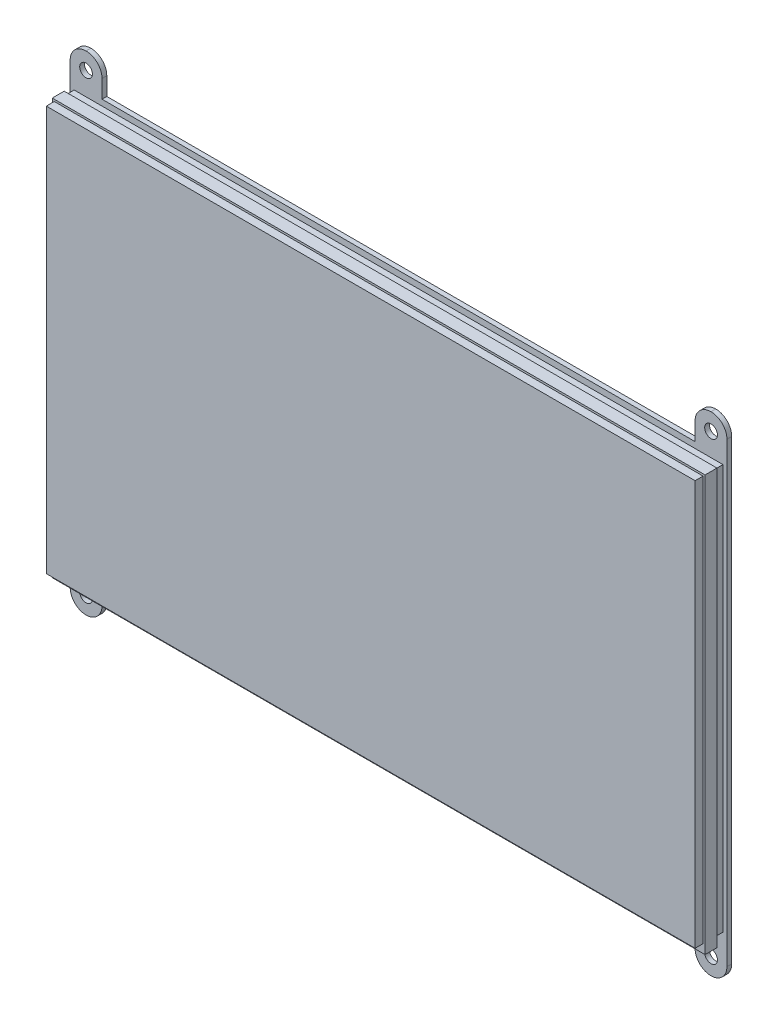
from build123d import *

# Parameters (mm, degrees)
ESQUISSE1_R             = 1.6
BOSS_EXTRU_1_DEPTH      = 1.2
ESQUISSE1_3_W           = 163
ESQUISSE1_3_H           = 101.73
BOSS_EXTRU_2_DEPTH      = 2
ESQUISSE3_W             = 164
ESQUISSE3_H             = 104.365
BOSS_EXTRU_4_DEPTH      = 3
ESQUISSE4_W             = 163
ESQUISSE4_H             = 101.73
BOSS_EXTRU_5_DEPTH      = 2
ESQUISSE5_W             = 37.5
ESQUISSE5_H             = 5
ESQUISSE5_W_2           = 5
ESQUISSE5_H_2           = 2
ENL_V_MAT_EXTRU_1_DEPTH = 1.2
ESQUISSE6_W             = 0.664850428
ESQUISSE6_H             = 2.706891026
ESQUISSE6_W_2           = 0.664850427
ESQUISSE6_H_2           = 3.704166667
ESQUISSE6_H_3           = 3.799145299
ESQUISSE6_W_3           = 1.282211538
ESQUISSE6_H_4           = 0.617361111
ENL_V_MAT_EXTRU_2_DEPTH = 0.1
ESQUISSE7_W             = 0.474893162
ESQUISSE7_H             = 2.713675214
ESQUISSE7_H_2           = 1.93349359
ENL_V_MAT_EXTRU_3_DEPTH = 0.1


with BuildPart() as part:
    # Esquisse1 → Boss.-Extru.1 (new body)
    with BuildSketch(Plane.XY):
        with BuildLine():
            Line((-74.5, 52.865), (74.5, 52.865))
            Line((74.5, 52.865), (74.5, 57.375))
            ThreePointArc((74.5, 57.375), (75.668643943, 60.196356057), (78.49, 61.365))
            Line((78.49, 61.365), (78.51, 61.365))
            ThreePointArc((78.51, 61.365), (81.331356057, 60.196356057), (82.5, 57.375))
            Line((82.5, 57.375), (82.5, -57.375))
            ThreePointArc((82.5, -57.375), (81.331356057, -60.196356057), (78.51, -61.365))
            Line((78.51, -61.365), (78.49, -61.365))
            ThreePointArc((78.49, -61.365), (75.668643943, -60.196356057), (74.5, -57.375))
            Line((74.5, -57.375), (74.5, -52.865))
            Line((74.5, -52.865), (-74.5, -52.865))
            Line((-74.5, -52.865), (-74.5, -57.375))
            ThreePointArc((-74.5, -57.375), (-75.668643943, -60.196356057), (-78.49, -61.365))
            Line((-78.49, -61.365), (-78.51, -61.365))
            ThreePointArc((-78.51, -61.365), (-81.331356057, -60.196356057), (-82.5, -57.375))
            Line((-82.5, -57.375), (-82.5, 57.375))
            ThreePointArc((-82.5, 57.375), (-81.331356057, 60.196356057), (-78.51, 61.365))
            Line((-78.51, 61.365), (-78.49, 61.365))
            ThreePointArc((-78.49, 61.365), (-75.668643943, 60.196356057), (-74.5, 57.375))
            Line((-74.5, 57.375), (-74.5, 52.865))
        make_face()
        with Locations((-78.51, 57.115)):
            Circle(ESQUISSE1_R, mode=Mode.SUBTRACT)
        with Locations(Location((78.51, 57.115, 0), (0, 0, 180))):
            Circle(ESQUISSE1_R, mode=Mode.SUBTRACT)
        with Locations((78.51, -57.115)):
            Circle(ESQUISSE1_R, mode=Mode.SUBTRACT)
        with Locations(Location((-78.51, -57.115, 0), (0, 0, 180))):
            Circle(ESQUISSE1_R, mode=Mode.SUBTRACT)
    extrude(amount=-BOSS_EXTRU_1_DEPTH)

    # Esquisse1<3> → Boss.-Extru.2 (add)
    with BuildSketch(Plane.XY):
        with Locations((0, 0.5)):
            Rectangle(ESQUISSE1_3_W, ESQUISSE1_3_H)
    extrude(amount=BOSS_EXTRU_2_DEPTH)

    # Esquisse3 → Boss.-Extru.4 (add)
    with BuildSketch(Plane.XY.offset(2)):
        with Locations((0, -0.3175)):
            Rectangle(ESQUISSE3_W, ESQUISSE3_H)
    extrude(amount=BOSS_EXTRU_4_DEPTH)

    # Esquisse4 → Boss.-Extru.5 (add)
    with BuildSketch(Plane.XY.offset(5)):
        with Locations((0, 0.5)):
            Rectangle(ESQUISSE4_W, ESQUISSE4_H)
    extrude(amount=BOSS_EXTRU_5_DEPTH)

    # Esquisse5 → Enlèv. mat.-Extru.1 (cut)
    with BuildSketch(Plane(origin=(0, 0, -1.2), x_dir=(-1, 0, 0), z_dir=(0, 0, -1))):
        with Locations((0, -30.865)):
            Rectangle(ESQUISSE5_W, ESQUISSE5_H)
        with Locations((-57.5, 11.635)):
            Rectangle(ESQUISSE5_W_2, ESQUISSE5_H_2)
    extrude(amount=-ENL_V_MAT_EXTRU_1_DEPTH, mode=Mode.SUBTRACT)

    # Esquisse6 → Enlèv. mat.-Extru.2 (cut)
    # profile 1 of 20: a face of its own
    with BuildSketch(Plane(origin=(0, 0, -1.2), x_dir=(-1, 0, 0), z_dir=(0, 0, -1))):
        Polygon((24.054727564, -29.660833333), (26.429193376, -29.660833333), (26.429193376, -30.005872897), (24.795264089, -33.459978632), (24.20609976, -33.163170406), (25.571417601, -30.278194444), (24.054727564, -30.278194444), align=None)
    # profile 2 of 20: a face of its own
    with BuildSketch(Plane(origin=(0, 0, -1.2), x_dir=(-1, 0, 0), z_dir=(0, 0, -1))):
        with BuildLine():
            add(Edge.make_bspline(
                [(27.235027711, -29.518365385), (27.26368276, -29.51977131), (27.319949709, -29.522531979), (27.40055977, -29.549442366), (27.474543469, -29.591677413), (27.539947111, -29.649624904), (27.594343745, -29.718824808), (27.635904793, -29.796298701), (27.659056722, -29.882137279), (27.662272182, -29.941433671), (27.663915598, -29.971739951)],
                knots=[0, 0, 0, 0, 0.989868614, 1.943702388, 2.910836514, 3.924849579, 4.949916355, 5.946401046, 6.950409252, 8, 8, 8, 8], degree=3))
            add(Edge.make_bspline(
                [(27.663915598, -29.971739951), (27.662330981, -30.00182289), (27.659243278, -30.060440929), (27.635371937, -30.145114209), (27.595479005, -30.222550472), (27.540641793, -30.290722629), (27.475947212, -30.347736842), (27.403580113, -30.390738641), (27.32374253, -30.416152009), (27.268348674, -30.419143455), (27.240221855, -30.420662393)],
                knots=[0, 0, 0, 0, 1.05296456, 2.051751585, 3.055639087, 4.085634717, 5.099016424, 6.062201612, 7.016062274, 8, 8, 8, 8], degree=3))
            add(Edge.make_bspline(
                [(27.240221855, -30.420662393), (27.211316671, -30.419261494), (27.154560202, -30.416510773), (27.073288972, -30.389537423), (26.99831852, -30.347635004), (26.933198598, -30.288503555), (26.878179002, -30.218811934), (26.838433356, -30.139534382), (26.813571472, -30.053108841), (26.810620388, -29.99293423), (26.809107906, -29.962093683)],
                knots=[0, 0, 0, 0, 0.989065327, 1.942068821, 2.907541208, 3.917690034, 4.939857478, 5.938239964, 6.943311734, 8, 8, 8, 8], degree=3))
            add(Edge.make_bspline(
                [(26.809107906, -29.962093683), (26.8107539, -29.93252157), (26.813987218, -29.874431424), (26.83727783, -29.790501289), (26.877885885, -29.714329853), (26.931890694, -29.646396718), (26.996719872, -29.589530166), (27.070659157, -29.548577825), (27.15072671, -29.522778914), (27.206637228, -29.519851752), (27.235027711, -29.518365385)],
                knots=[0, 0, 0, 0, 1.038616768, 2.040212704, 3.031499824, 4.052181184, 5.074969369, 6.039807101, 7.004644834, 8, 8, 8, 8], degree=3))
        make_face()
    # profile 3 of 20: a face of its own
    with BuildSketch(Plane(origin=(0, 0, -1.2), x_dir=(-1, 0, 0), z_dir=(0, 0, -1))):
        with Locations((27.236511752, -32.011554487)):
            Rectangle(ESQUISSE6_W, ESQUISSE6_H)
    # profile 4 of 20: a face of its own
    with BuildSketch(Plane(origin=(0, 0, -1.2), x_dir=(-1, 0, 0), z_dir=(0, 0, -1))):
        with BuildLine():
            Line((28.186298077, -30.658108974), (28.851148504, -30.658108974))
            Line((28.851148504, -30.658108974), (28.851148504, -30.944528913))
            add(Edge.make_bspline(
                [(28.851148504, -30.944528913), (28.889077892, -30.915026654), (28.961568324, -30.858642103), (29.071766297, -30.786751513), (29.17577954, -30.727911951), (29.27592662, -30.68315557), (29.374091806, -30.650955278), (29.471864955, -30.627821289), (29.570702105, -30.61300796), (29.637144662, -30.611415332), (29.670339209, -30.610619658)],
                knots=[0, 0, 0, 0, 1.276643801, 2.439914479, 3.493451431, 4.44993799, 5.350072675, 6.235028322, 7.118224225, 8, 8, 8, 8], degree=3))
            add(Edge.make_bspline(
                [(29.670339209, -30.610619658), (29.704010611, -30.611528948), (29.770110401, -30.613313961), (29.867438699, -30.625798681), (29.960426435, -30.64853731), (30.050119181, -30.67872806), (30.135604017, -30.718578118), (30.217928185, -30.765893597), (30.29532339, -30.823527051), (30.342986784, -30.867417922), (30.367096521, -30.889619391)],
                knots=[0, 0, 0, 0, 1.048836932, 2.058954983, 3.049370783, 4.026390553, 5.001981509, 5.982488534, 6.97947532, 8, 8, 8, 8], degree=3))
            add(Edge.make_bspline(
                [(30.367096521, -30.889619391), (30.386433417, -30.91019366), (30.425248733, -30.951492778), (30.474092931, -31.022166146), (30.516006746, -31.099213054), (30.550349294, -31.183522261), (30.575727054, -31.275556993), (30.595250511, -31.374205601), (30.606205463, -31.480020445), (30.607557903, -31.552714244), (30.608253205, -31.590086806)],
                knots=[0, 0, 0, 0, 0.889584746, 1.785680191, 2.700364693, 3.65222533, 4.649950538, 5.707241244, 6.821271309, 8, 8, 8, 8], degree=3))
            Line((30.608253205, -31.590086806), (30.608253205, -33.365))
            Line((30.608253205, -33.365), (29.943402778, -33.365))
            Line((29.943402778, -33.365), (29.943402778, -32.189639423))
            add(Edge.make_bspline(
                [(29.943402778, -32.189639423), (29.943262177, -32.151301209), (29.942992741, -32.077833136), (29.940924068, -31.972689284), (29.936884813, -31.877730731), (29.933203138, -31.792784585), (29.925974546, -31.718152463), (29.919455684, -31.653361885), (29.909453124, -31.599000637), (29.89643817, -31.540526959), (29.873710855, -31.477920193), (29.838427806, -31.411953622), (29.79366631, -31.355913549), (29.741254607, -31.309407106), (29.68125058, -31.272616244), (29.614379291, -31.24673158), (29.540999249, -31.230599623), (29.489868898, -31.228875931), (29.463315471, -31.227980769)],
                knots=[0, 0, 0, 0, 1.49886392, 2.872294502, 4.110984203, 5.214877267, 6.195405875, 7.042225351, 7.75923308, 8.355011229, 9.382752534, 10.352059385, 11.267231453, 12.171456522, 13.078624015, 14.003401117, 14.963110155, 16, 16, 16, 16], degree=3))
            add(Edge.make_bspline(
                [(29.463315471, -31.227980769), (29.428781623, -31.22973199), (29.361226703, -31.233157718), (29.263522026, -31.258990833), (29.173781908, -31.302925357), (29.092739599, -31.363721905), (29.021166961, -31.438782776), (28.962217837, -31.528301475), (28.913867445, -31.630117475), (28.893076058, -31.704459692), (28.882313368, -31.742943042)],
                knots=[0, 0, 0, 0, 0.984188326, 1.925263693, 2.85911992, 3.81709677, 4.80007086, 5.801799564, 6.862098548, 8, 8, 8, 8], degree=3))
            add(Edge.make_bspline(
                [(28.882313368, -31.742943042), (28.879638412, -31.755028996), (28.873672722, -31.781983104), (28.868766697, -31.827519122), (28.86194206, -31.881543198), (28.859385036, -31.945033017), (28.854938653, -32.017688108), (28.853294169, -32.09960459), (28.851646741, -32.190621841), (28.851320085, -32.254193933), (28.851148504, -32.287586138)],
                knots=[0, 0, 0, 0, 0.543362196, 1.211806945, 2.009705693, 2.934833164, 4.000995085, 5.207458376, 6.533175157, 8, 8, 8, 8], degree=3))
            Line((28.851148504, -32.287586138), (28.851148504, -33.365))
            Line((28.851148504, -33.365), (28.186298077, -33.365))
            Line((28.186298077, -33.365), (28.186298077, -30.658108974))
        make_face()
    # profile 5 of 20: a face of its own
    with BuildSketch(Plane(origin=(0, 0, -1.2), x_dir=(-1, 0, 0), z_dir=(0, 0, -1))):
        with BuildLine():
            Line((33.885016026, -31.210172276), (33.334436765, -31.512916667))
            add(Edge.make_bspline(
                [(33.334436765, -31.512916667), (33.309200219, -31.487644489), (33.260689232, -31.439065009), (33.182897965, -31.377571095), (33.106496726, -31.326655845), (33.028335807, -31.289083005), (32.947716544, -31.260787056), (32.861731097, -31.242046027), (32.769375865, -31.229705725), (32.705493646, -31.228567609), (32.67255442, -31.227980769)],
                knots=[0, 0, 0, 0, 1.150764855, 2.212059359, 3.192108068, 4.105322427, 5.000809612, 5.941206042, 6.938435785, 8, 8, 8, 8], degree=3))
            add(Edge.make_bspline(
                [(32.67255442, -31.227980769), (32.642346878, -31.228710393), (32.583233249, -31.230138205), (32.496858858, -31.240802984), (32.414768849, -31.257553284), (32.337110581, -31.282059033), (32.264022369, -31.31443246), (32.194899805, -31.352741542), (32.13041458, -31.398482579), (32.071478208, -31.451005374), (32.018277774, -31.508831807), (31.970820273, -31.570506184), (31.931941372, -31.636943428), (31.898328151, -31.706582023), (31.873615301, -31.780729939), (31.855534779, -31.85871436), (31.845229049, -31.94053874), (31.843735931, -31.996438772), (31.842975427, -32.024910857)],
                knots=[0, 0, 0, 0, 1.121765476, 2.195200973, 3.227634963, 4.230038321, 5.213228299, 6.192116585, 7.160777141, 8.14345191, 9.118668839, 10.075979138, 11.027630062, 11.972829041, 12.943187208, 13.923755399, 14.94248691, 16, 16, 16, 16], degree=3))
            add(Edge.make_bspline(
                [(31.842975427, -32.024910857), (31.843778965, -32.052639916), (31.84534793, -32.106782866), (31.854987119, -32.186331763), (31.871721115, -32.262058918), (31.89681155, -32.333563984), (31.926885243, -32.401506137), (31.964652295, -32.465345019), (32.009064267, -32.525359397), (32.060354972, -32.581027661), (32.117172056, -32.631094434), (32.178425328, -32.675308578), (32.243932033, -32.712793992), (32.314455259, -32.742211618), (32.388845196, -32.766180828), (32.467598621, -32.783247845), (32.550631729, -32.792721219), (32.607233297, -32.794313474), (32.636195413, -32.795128205)],
                knots=[0, 0, 0, 0, 1.070556293, 2.090336998, 3.088792742, 4.058148387, 5.011235098, 5.952916408, 6.915475435, 7.888633318, 8.869583867, 9.83422472, 10.800707077, 11.776204622, 12.778807041, 13.814557445, 14.881744048, 16, 16, 16, 16], degree=3))
            add(Edge.make_bspline(
                [(32.636195413, -32.795128205), (32.671854719, -32.794312216), (32.741456502, -32.792719524), (32.842637296, -32.779210819), (32.937847038, -32.756872172), (33.027095826, -32.725953711), (33.110258799, -32.685527247), (33.187122275, -32.636149337), (33.258476409, -32.578184234), (33.300086209, -32.532993335), (33.321080395, -32.510192308)],
                knots=[0, 0, 0, 0, 1.116373375, 2.178998604, 3.189797796, 4.174590301, 5.13072713, 6.078291395, 7.030403691, 8, 8, 8, 8], degree=3))
            Line((33.321080395, -32.510192308), (33.837526709, -32.864878138))
            add(Edge.make_bspline(
                [(33.837526709, -32.864878138), (33.801729131, -32.908645204), (33.731085333, -32.99501618), (33.607831496, -33.106345216), (33.475173138, -33.202001594), (33.330442215, -33.278353304), (33.175746487, -33.339081328), (33.009877155, -33.382010012), (32.833114776, -33.407280299), (32.711717485, -33.410725223), (32.649551783, -33.412489316)],
                knots=[0, 0, 0, 0, 0.997876357, 1.969233105, 2.924898516, 3.881013542, 4.852507933, 5.855329832, 6.901747111, 8, 8, 8, 8], degree=3))
            add(Edge.make_bspline(
                [(32.649551783, -33.412489316), (32.593598796, -33.411195849), (32.484316442, -33.408669565), (32.325040127, -33.389322998), (32.175232482, -33.35673634), (32.03458533, -33.311480168), (31.9032269, -33.25285648), (31.781583199, -33.180141202), (31.668833743, -33.095357008), (31.567012985, -32.998103383), (31.476165505, -32.892241761), (31.396855328, -32.780752641), (31.328264259, -32.665633585), (31.274454632, -32.544968479), (31.230477337, -32.420638095), (31.200776452, -32.291156238), (31.181186889, -32.157589469), (31.179153845, -32.067029577), (31.178125, -32.021200755)],
                knots=[0, 0, 0, 0, 1.183377041, 2.311265848, 3.387807024, 4.421911742, 5.431260577, 6.423665966, 7.413571885, 8.409103097, 9.395976332, 10.359992013, 11.300391101, 12.225292883, 13.150239058, 14.085544813, 15.031169026, 16, 16, 16, 16], degree=3))
            add(Edge.make_bspline(
                [(31.178125, -32.021200755), (31.17867616, -31.989271425), (31.179767837, -31.926029241), (31.18908731, -31.832107544), (31.203585279, -31.739779661), (31.225374014, -31.649693685), (31.252170313, -31.561412551), (31.284744842, -31.474954007), (31.324382461, -31.390764191), (31.368598346, -31.308126935), (31.41899214, -31.229223742), (31.473970725, -31.154089434), (31.533456639, -31.083184174), (31.598148693, -31.017168781), (31.667595811, -30.955570889), (31.740788414, -30.897140788), (31.820094978, -30.844891856), (31.9027585, -30.795768208), (31.989491042, -30.7520387), (32.079295731, -30.71429437), (32.171478578, -30.682225117), (32.26626054, -30.656440791), (32.363234795, -30.635189779), (32.463264242, -30.621703014), (32.565521304, -30.612223456), (32.63468886, -30.61115748), (32.669586338, -30.610619658)],
                knots=[0, 0, 0, 0, 1.00272354, 1.986087015, 2.96193297, 3.936200312, 4.894695956, 5.858592327, 6.835334787, 7.815655071, 8.800643866, 9.773423113, 10.738352213, 11.705312252, 12.673769326, 13.65298065, 14.64420052, 15.654211674, 16.672258995, 17.692438602, 18.712115155, 19.735602823, 20.776372304, 21.827874031, 22.90408564, 24, 24, 24, 24], degree=3))
            add(Edge.make_bspline(
                [(32.669586338, -30.610619658), (32.702001618, -30.61098614), (32.765931404, -30.611708921), (32.860341246, -30.619266597), (32.95217578, -30.632103642), (33.04159129, -30.649086511), (33.128859331, -30.670131244), (33.212810279, -30.698183167), (33.294591885, -30.730021045), (33.399927457, -30.778092915), (33.524098817, -30.849847961), (33.660405703, -30.952760516), (33.781939793, -31.073153196), (33.850474661, -31.164256492), (33.885016026, -31.210172276)],
                knots=[0, 0, 0, 0, 0.826738014, 1.630502179, 2.413926014, 3.191023582, 3.95155221, 4.701751672, 5.446919844, 6.189438973, 7.653650558, 9.094719814, 10.535747635, 12, 12, 12, 12], degree=3))
        make_face()
    # profile 6 of 20: a face of its own
    with BuildSketch(Plane(origin=(0, 0, -1.2), x_dir=(-1, 0, 0), z_dir=(0, 0, -1))):
        with BuildLine():
            Line((34.549866453, -29.565854701), (35.21471688, -29.565854701))
            Line((35.21471688, -29.565854701), (35.21471688, -30.951207098))
            add(Edge.make_bspline(
                [(35.21471688, -30.951207098), (35.248206806, -30.923971113), (35.313484473, -30.870883458), (35.415907273, -30.80172284), (35.518118224, -30.742705042), (35.621201935, -30.694875152), (35.724711192, -30.657393668), (35.828824737, -30.630812425), (35.933642799, -30.613372784), (36.003911262, -30.611538345), (36.039101729, -30.610619658)],
                knots=[0, 0, 0, 0, 1.13710654, 2.216417683, 3.252896077, 4.244436563, 5.207303112, 6.149540546, 7.073289332, 8, 8, 8, 8], degree=3))
            add(Edge.make_bspline(
                [(36.039101729, -30.610619658), (36.072776645, -30.611513194), (36.138883333, -30.613267281), (36.235865851, -30.625937296), (36.328755737, -30.647739125), (36.417781818, -30.677709519), (36.502331614, -30.718015284), (36.5835046, -30.765228399), (36.660335927, -30.821794127), (36.707083413, -30.865397748), (36.730664897, -30.887393329)],
                knots=[0, 0, 0, 0, 1.056403236, 2.073808271, 3.062028718, 4.046096703, 5.014652014, 5.995532726, 6.988858718, 8, 8, 8, 8], degree=3))
            add(Edge.make_bspline(
                [(36.730664897, -30.887393329), (36.750031521, -30.907946185), (36.789045758, -30.949350098), (36.837636949, -31.020729488), (36.879594957, -31.098479357), (36.913784752, -31.183330313), (36.939212229, -31.275321854), (36.958898252, -31.373696141), (36.969785041, -31.479527309), (36.971128621, -31.552467465), (36.971821581, -31.590086806)],
                knots=[0, 0, 0, 0, 0.887296576, 1.787466942, 2.706642908, 3.663267187, 4.658426068, 5.705361056, 6.816525637, 8, 8, 8, 8], degree=3))
            Line((36.971821581, -31.590086806), (36.971821581, -33.365))
            Line((36.971821581, -33.365), (36.306971154, -33.365))
            Line((36.306971154, -33.365), (36.306971154, -32.188155382))
            add(Edge.make_bspline(
                [(36.306971154, -32.188155382), (36.306841972, -32.150805887), (36.306594705, -32.079315099), (36.304374238, -31.976652452), (36.300748147, -31.883387362), (36.295789302, -31.799491643), (36.288865672, -31.725315911), (36.282055794, -31.660328502), (36.27249994, -31.604840923), (36.25819126, -31.544548396), (36.234905148, -31.480060672), (36.201066638, -31.411319531), (36.155867685, -31.354586961), (36.103561076, -31.307796815), (36.043082409, -31.272084805), (35.976596761, -31.245708535), (35.902967523, -31.230875172), (35.851931049, -31.22897077), (35.825399806, -31.227980769)],
                knots=[0, 0, 0, 0, 1.461461505, 2.797388094, 4.017818807, 5.113567707, 6.085313608, 6.932873269, 7.669572396, 8.286941306, 9.355291607, 10.346554054, 11.270113241, 12.175128673, 13.078071705, 14.003657132, 14.962203834, 16, 16, 16, 16], degree=3))
            add(Edge.make_bspline(
                [(35.825399806, -31.227980769), (35.790837457, -31.229331925), (35.7231432, -31.231978317), (35.626066642, -31.259219752), (35.536526287, -31.302278298), (35.455567156, -31.361955506), (35.385019865, -31.436703585), (35.325912122, -31.524315799), (35.277565225, -31.623915835), (35.256668825, -31.696545903), (35.245881744, -31.734038795)],
                knots=[0, 0, 0, 0, 0.993549393, 1.945978497, 2.879753144, 3.843180486, 4.826017097, 5.826060929, 6.877775219, 8, 8, 8, 8], degree=3))
            add(Edge.make_bspline(
                [(35.245881744, -31.734038795), (35.243195738, -31.745627303), (35.237070765, -31.772052892), (35.232380144, -31.817139486), (35.225419338, -31.871641452), (35.223004746, -31.935885395), (35.218481643, -32.009772227), (35.216854958, -32.093421489), (35.215217298, -32.186911826), (35.214889049, -32.252462546), (35.21471688, -32.286844117)],
                knots=[0, 0, 0, 0, 0.514379255, 1.17295301, 1.959069106, 2.891908278, 3.953016936, 5.163065833, 6.51201855, 8, 8, 8, 8], degree=3))
            Line((35.21471688, -32.286844117), (35.21471688, -33.365))
            Line((35.21471688, -33.365), (34.549866453, -33.365))
            Line((34.549866453, -33.365), (34.549866453, -29.565854701))
        make_face()
    # profile 7 of 20: a face of its own
    with BuildSketch(Plane(origin=(0, 0, -1.2), x_dir=(-1, 0, 0), z_dir=(0, 0, -1))):
        Polygon((39.156330128, -29.660833333), (39.821180556, -29.660833333), (39.821180556, -31.085512821), (41.103392094, -31.085512821), (41.103392094, -29.660833333), (41.768242521, -29.660833333), (41.768242521, -33.365), (41.103392094, -33.365), (41.103392094, -31.750363248), (39.821180556, -31.750363248), (39.821180556, -33.365), (39.156330128, -33.365), align=None)
    # profile 8 of 20: a face of its own
    with BuildSketch(Plane(origin=(0, 0, -1.2), x_dir=(-1, 0, 0), z_dir=(0, 0, -1))):
        with BuildLine():
            Line((42.623050214, -29.660833333), (43.460791433, -29.660833333))
            add(Edge.make_bspline(
                [(43.460791433, -29.660833333), (43.526102997, -29.661289884), (43.652350988, -29.6621724), (43.835259351, -29.672116241), (44.005340853, -29.687409161), (44.162705132, -29.708447345), (44.307029566, -29.736286624), (44.438128052, -29.771205543), (44.556440586, -29.811513625), (44.663264442, -29.858944263), (44.760784349, -29.914243676), (44.853382612, -29.975842784), (44.940877418, -30.045998139), (45.024496617, -30.123356308), (45.103161087, -30.209332532), (45.178180872, -30.302502734), (45.247719149, -30.404218012), (45.313877907, -30.512039552), (45.373709701, -30.626424293), (45.425897227, -30.746398616), (45.469615035, -30.871190441), (45.505138017, -31.000932763), (45.533453933, -31.135194879), (45.55326601, -31.274247715), (45.565514032, -31.417962532), (45.566756492, -31.515365121), (45.567387821, -31.564858106)],
                knots=[0, 0, 0, 0, 1.44355588, 2.790409838, 4.047694926, 5.217575253, 6.298404546, 7.294384826, 8.214239204, 9.058592145, 9.873746385, 10.689560431, 11.514393297, 12.350027578, 13.205127629, 14.088021785, 14.991911688, 15.926770944, 16.882954281, 17.842803888, 18.816321264, 19.80318086, 20.814351908, 21.847355356, 22.906180909, 24, 24, 24, 24], degree=3))
            add(Edge.make_bspline(
                [(45.567387821, -31.564858106), (45.565734662, -31.634695931), (45.562480322, -31.772175776), (45.53506758, -31.973925865), (45.490731894, -32.167323448), (45.428391892, -32.350855693), (45.351106979, -32.522888219), (45.258781496, -32.680387305), (45.152769149, -32.822507575), (45.034304989, -32.948541387), (44.906037155, -33.056869156), (44.772741011, -33.149643963), (44.633118008, -33.22280464), (44.51009063, -33.269199449), (44.403410545, -33.298053007), (44.309746584, -33.315105737), (44.203353881, -33.33074412), (44.083240417, -33.342829125), (43.949933103, -33.35360598), (43.802900575, -33.359461703), (43.642618882, -33.36432694), (43.531288092, -33.364769768), (43.473405783, -33.365)],
                knots=[0, 0, 0, 0, 1.315458931, 2.589557908, 3.828601765, 5.048913369, 6.235739168, 7.376350998, 8.481830359, 9.569842114, 10.627874879, 11.640079404, 12.624025415, 13.590060155, 14.111227486, 14.704434459, 15.382649715, 16.137166398, 16.978595427, 17.902333227, 18.909396075, 20, 20, 20, 20], degree=3))
            Line((43.473405783, -33.365), (42.623050214, -33.365))
            Line((42.623050214, -33.365), (42.623050214, -29.660833333))
        make_face()
        with BuildLine():
            Line((43.287900641, -30.325683761), (43.287900641, -32.700149573))
            Line((43.287900641, -32.700149573), (43.635166266, -32.700149573))
            add(Edge.make_bspline(
                [(43.635166266, -32.700149573), (43.676485542, -32.700073859), (43.755956266, -32.699928235), (43.870694001, -32.692992073), (43.976797314, -32.68603008), (44.073974126, -32.672815983), (44.162931661, -32.658096408), (44.242447874, -32.637612105), (44.314161941, -32.61609508), (44.377197887, -32.58870124), (44.434933678, -32.55786765), (44.488390425, -32.521742525), (44.539991153, -32.481626936), (44.588771145, -32.436341026), (44.63491502, -32.386484466), (44.678149763, -32.331800368), (44.719052443, -32.272455574), (44.756573165, -32.208136313), (44.790859802, -32.139521812), (44.821275891, -32.067276702), (44.846495317, -31.990799336), (44.867456159, -31.910805635), (44.882435058, -31.826599163), (44.89482724, -31.738803626), (44.901215771, -31.647071185), (44.902092557, -31.584653366), (44.902537393, -31.552985777)],
                knots=[0, 0, 0, 0, 1.50275155, 2.890291501, 4.180787663, 5.369391935, 6.45668281, 7.458360028, 8.354766181, 9.177074746, 9.954075863, 10.732690366, 11.5210699, 12.329727389, 13.151100085, 13.990027547, 14.863562427, 15.770965086, 16.696477834, 17.652329173, 18.619756807, 19.62365428, 20.657822005, 21.729286259, 22.847956731, 24, 24, 24, 24], degree=3))
            add(Edge.make_bspline(
                [(44.902537393, -31.552985777), (44.901651431, -31.504458192), (44.899923872, -31.40983316), (44.883263675, -31.272009736), (44.856144051, -31.142228335), (44.817446961, -31.020970611), (44.768668079, -30.907895766), (44.707609938, -30.803961784), (44.636900245, -30.707422717), (44.580984949, -30.650789803), (44.553045706, -30.622491987)],
                knots=[0, 0, 0, 0, 1.13821349, 2.219428113, 3.251817212, 4.244760574, 5.201143372, 6.134805572, 7.068016741, 8, 8, 8, 8], degree=3))
            add(Edge.make_bspline(
                [(44.553045706, -30.622491987), (44.525494968, -30.598378423), (44.469225703, -30.549129198), (44.370435366, -30.490116032), (44.261573531, -30.438267181), (44.140149765, -30.397156824), (44.007337576, -30.364645002), (43.862345931, -30.342222393), (43.705951292, -30.327813862), (43.597604731, -30.326409006), (43.541671675, -30.325683761)],
                knots=[0, 0, 0, 0, 0.813307809, 1.661089106, 2.549956539, 3.493439533, 4.508053171, 5.589449661, 6.755572447, 8, 8, 8, 8], degree=3))
            Line((43.541671675, -30.325683761), (43.287900641, -30.325683761))
        make_face(mode=Mode.SUBTRACT)
    # profile 9 of 20: a face of its own
    with BuildSketch(Plane(origin=(0, 0, -1.2), x_dir=(-1, 0, 0), z_dir=(0, 0, -1))):
        Polygon((46.525336372, -29.660833333), (47.215415498, -29.660833333), (48.060576923, -32.244548945), (48.911674513, -29.660833333), (49.595075454, -29.660833333), (50.221340812, -33.365), (49.548328158, -33.365), (49.152831197, -31.025409155), (48.382613849, -33.365), (47.734087874, -33.365), (46.96832265, -31.025409155), (46.573567708, -33.365), (45.899813034, -33.365), align=None)
    # profile 10 of 20: a face of its own
    with BuildSketch(Plane(origin=(0, 0, -1.2), x_dir=(-1, 0, 0), z_dir=(0, 0, -1))):
        with Locations((51.076148505, -31.512916667)):
            Rectangle(ESQUISSE6_W_2, ESQUISSE6_H_2)
    # profile 11 of 20: a face of its own
    with BuildSketch(Plane(origin=(0, 0, -1.2), x_dir=(-1, 0, 0), z_dir=(0, 0, -1))):
        with BuildLine():
            Line((53.688060897, -29.660833333), (54.525802117, -29.660833333))
            add(Edge.make_bspline(
                [(54.525802117, -29.660833333), (54.59111368, -29.661289884), (54.717361672, -29.6621724), (54.900270035, -29.672116241), (55.070351537, -29.687409161), (55.227715816, -29.708447345), (55.37204025, -29.736286624), (55.503138735, -29.771205543), (55.62145127, -29.811513625), (55.728275126, -29.858944263), (55.825795032, -29.914243676), (55.918393295, -29.975842784), (56.005888101, -30.045998139), (56.089507301, -30.123356308), (56.168171771, -30.209332532), (56.243191556, -30.302502734), (56.312729832, -30.404218012), (56.378888591, -30.512039552), (56.438720385, -30.626424293), (56.490907911, -30.746398616), (56.534625718, -30.871190441), (56.570148701, -31.000932763), (56.598464617, -31.135194879), (56.618276693, -31.274247715), (56.630524716, -31.417962532), (56.631767176, -31.515365121), (56.632398504, -31.564858106)],
                knots=[0, 0, 0, 0, 1.44355588, 2.790409838, 4.047694926, 5.217575253, 6.298404546, 7.294384826, 8.214239204, 9.058592145, 9.873746385, 10.689560431, 11.514393297, 12.350027578, 13.205127629, 14.088021785, 14.991911688, 15.926770944, 16.882954281, 17.842803888, 18.816321264, 19.80318086, 20.814351908, 21.847355356, 22.906180909, 24, 24, 24, 24], degree=3))
            add(Edge.make_bspline(
                [(56.632398504, -31.564858106), (56.630745345, -31.634695931), (56.627491005, -31.772175776), (56.600078263, -31.973925865), (56.555742577, -32.167323448), (56.493402576, -32.350855693), (56.416117663, -32.522888219), (56.323792179, -32.680387305), (56.217779832, -32.822507575), (56.099315672, -32.948541387), (55.971047839, -33.056869156), (55.837751694, -33.149643963), (55.698128692, -33.22280464), (55.575101314, -33.269199449), (55.468421228, -33.298053007), (55.374757268, -33.315105737), (55.268364565, -33.33074412), (55.148251101, -33.342829125), (55.014943787, -33.35360598), (54.867911259, -33.359461703), (54.707629566, -33.36432694), (54.596298776, -33.364769768), (54.538416466, -33.365)],
                knots=[0, 0, 0, 0, 1.315458931, 2.589557908, 3.828601765, 5.048913369, 6.235739168, 7.376350998, 8.481830359, 9.569842114, 10.627874879, 11.640079404, 12.624025415, 13.590060155, 14.111227486, 14.704434459, 15.382649715, 16.137166398, 16.978595427, 17.902333227, 18.909396075, 20, 20, 20, 20], degree=3))
            Line((54.538416466, -33.365), (53.688060897, -33.365))
            Line((53.688060897, -33.365), (53.688060897, -29.660833333))
        make_face()
        with BuildLine():
            Line((54.352911325, -30.325683761), (54.352911325, -32.700149573))
            Line((54.352911325, -32.700149573), (54.70017695, -32.700149573))
            add(Edge.make_bspline(
                [(54.70017695, -32.700149573), (54.741496226, -32.700073859), (54.820966949, -32.699928235), (54.935704685, -32.692992073), (55.041807998, -32.68603008), (55.13898481, -32.672815983), (55.227942345, -32.658096408), (55.307458558, -32.637612105), (55.379172624, -32.61609508), (55.442208571, -32.58870124), (55.499944362, -32.55786765), (55.553401109, -32.521742525), (55.605001837, -32.481626936), (55.653781829, -32.436341026), (55.699925704, -32.386484466), (55.743160447, -32.331800368), (55.784063126, -32.272455574), (55.821583849, -32.208136313), (55.855870485, -32.139521812), (55.886286574, -32.067276702), (55.911506, -31.990799336), (55.932466843, -31.910805635), (55.947445742, -31.826599163), (55.959837924, -31.738803626), (55.966226455, -31.647071185), (55.967103241, -31.584653366), (55.967548077, -31.552985777)],
                knots=[0, 0, 0, 0, 1.50275155, 2.890291501, 4.180787663, 5.369391935, 6.45668281, 7.458360028, 8.354766181, 9.177074746, 9.954075863, 10.732690366, 11.5210699, 12.329727389, 13.151100085, 13.990027547, 14.863562427, 15.770965086, 16.696477834, 17.652329173, 18.619756807, 19.62365428, 20.657822005, 21.729286259, 22.847956731, 24, 24, 24, 24], degree=3))
            add(Edge.make_bspline(
                [(55.967548077, -31.552985777), (55.966662114, -31.504458192), (55.964934556, -31.40983316), (55.948274358, -31.272009736), (55.921154735, -31.142228335), (55.882457645, -31.020970611), (55.833678763, -30.907895766), (55.772620622, -30.803961784), (55.701910929, -30.707422717), (55.645995633, -30.650789803), (55.61805639, -30.622491987)],
                knots=[0, 0, 0, 0, 1.13821349, 2.219428113, 3.251817212, 4.244760574, 5.201143372, 6.134805572, 7.068016741, 8, 8, 8, 8], degree=3))
            add(Edge.make_bspline(
                [(55.61805639, -30.622491987), (55.590505651, -30.598378423), (55.534236387, -30.549129198), (55.43544605, -30.490116032), (55.326584214, -30.438267181), (55.205160449, -30.397156824), (55.07234826, -30.364645002), (54.927356615, -30.342222393), (54.770961976, -30.327813862), (54.662615414, -30.326409006), (54.606682358, -30.325683761)],
                knots=[0, 0, 0, 0, 0.813307809, 1.661089106, 2.549956539, 3.493439533, 4.508053171, 5.589449661, 6.755572447, 8, 8, 8, 8], degree=3))
            Line((54.606682358, -30.325683761), (54.352911325, -30.325683761))
        make_face(mode=Mode.SUBTRACT)
    # profile 12 of 20: a face of its own
    with BuildSketch(Plane(origin=(0, 0, -1.2), x_dir=(-1, 0, 0), z_dir=(0, 0, -1))):
        with BuildLine():
            add(Edge.make_bspline(
                [(57.485722155, -29.518365385), (57.514377204, -29.51977131), (57.570644153, -29.522531979), (57.651254214, -29.549442366), (57.725237914, -29.591677413), (57.790641556, -29.649624904), (57.845038189, -29.718824808), (57.886599238, -29.796298701), (57.909751166, -29.882137279), (57.912966627, -29.941433671), (57.914610043, -29.971739951)],
                knots=[0, 0, 0, 0, 0.989868614, 1.943702388, 2.910836514, 3.924849579, 4.949916355, 5.946401046, 6.950409252, 8, 8, 8, 8], degree=3))
            add(Edge.make_bspline(
                [(57.914610043, -29.971739951), (57.913025425, -30.00182289), (57.909937723, -30.060440929), (57.886066382, -30.145114209), (57.846173449, -30.222550472), (57.791336237, -30.290722629), (57.726641656, -30.347736842), (57.654274557, -30.390738641), (57.574436974, -30.416152009), (57.519043118, -30.419143455), (57.490916299, -30.420662393)],
                knots=[0, 0, 0, 0, 1.05296456, 2.051751585, 3.055639087, 4.085634717, 5.099016424, 6.062201612, 7.016062274, 8, 8, 8, 8], degree=3))
            add(Edge.make_bspline(
                [(57.490916299, -30.420662393), (57.462011116, -30.419261494), (57.405254647, -30.416510773), (57.323983417, -30.389537423), (57.249012964, -30.347635004), (57.183893043, -30.288503555), (57.128873446, -30.218811934), (57.089127801, -30.139534382), (57.064265917, -30.053108841), (57.061314833, -29.99293423), (57.05980235, -29.962093683)],
                knots=[0, 0, 0, 0, 0.989065327, 1.942068821, 2.907541208, 3.917690034, 4.939857478, 5.938239964, 6.943311734, 8, 8, 8, 8], degree=3))
            add(Edge.make_bspline(
                [(57.05980235, -29.962093683), (57.061448345, -29.93252157), (57.064681663, -29.874431424), (57.087972274, -29.790501289), (57.128580329, -29.714329853), (57.182585138, -29.646396718), (57.247414316, -29.589530166), (57.321353602, -29.548577825), (57.401421155, -29.522778914), (57.457331673, -29.519851752), (57.485722155, -29.518365385)],
                knots=[0, 0, 0, 0, 1.038616768, 2.040212704, 3.031499824, 4.052181184, 5.074969369, 6.039807101, 7.004644834, 8, 8, 8, 8], degree=3))
        make_face()
    # profile 13 of 20: a face of its own
    with BuildSketch(Plane(origin=(0, 0, -1.2), x_dir=(-1, 0, 0), z_dir=(0, 0, -1))):
        with Locations((57.487206197, -32.011554487)):
            Rectangle(ESQUISSE6_W_2, ESQUISSE6_H)
    # profile 14 of 20: a face of its own
    with BuildSketch(Plane(origin=(0, 0, -1.2), x_dir=(-1, 0, 0), z_dir=(0, 0, -1))):
        with BuildLine():
            Line((60.09911859, -31.075866553), (59.692491319, -31.512916667))
            add(Edge.make_bspline(
                [(59.692491319, -31.512916667), (59.672186472, -31.490448252), (59.63335099, -31.447474686), (59.573897621, -31.38889211), (59.515329628, -31.340110131), (59.458738422, -31.299131234), (59.402968208, -31.26770532), (59.348482562, -31.245095078), (59.295255341, -31.23074176), (59.259974089, -31.228883777), (59.242826856, -31.227980769)],
                knots=[0, 0, 0, 0, 1.327646587, 2.539285, 3.655602211, 4.666613517, 5.598770349, 6.454635452, 7.248928967, 8, 8, 8, 8], degree=3))
            add(Edge.make_bspline(
                [(59.242826856, -31.227980769), (59.225475579, -31.228509577), (59.19225328, -31.229522079), (59.145369172, -31.238206805), (59.104178346, -31.253241667), (59.069323612, -31.273735586), (59.041320702, -31.298981988), (59.021714559, -31.327863277), (59.008548854, -31.359481176), (59.00743512, -31.381940592), (59.006864316, -31.393451356)],
                knots=[0, 0, 0, 0, 1.295068245, 2.479652818, 3.543291146, 4.55379989, 5.481948265, 6.332409746, 7.145336708, 8, 8, 8, 8], degree=3))
            add(Edge.make_bspline(
                [(59.006864316, -31.393451356), (59.008798252, -31.410895138), (59.012810945, -31.44708896), (59.040372579, -31.489068394), (59.076838611, -31.520035763), (59.118873402, -31.548852678), (59.175799392, -31.581073075), (59.218984892, -31.603135322), (59.242826856, -31.615315505)],
                knots=[0, 0, 0, 0, 0.916701701, 1.902049539, 2.5493345, 3.440293453, 4.586830489, 6, 6, 6, 6], degree=3))
            Line((59.242826856, -31.615315505), (59.48324152, -31.737006878))
            add(Edge.make_bspline(
                [(59.48324152, -31.737006878), (59.513826862, -31.752537121), (59.573168171, -31.78266871), (59.656596491, -31.831290075), (59.733652219, -31.878417393), (59.802789637, -31.926716529), (59.864431912, -31.975348365), (59.918141201, -32.024793806), (59.965220225, -32.073485337), (60.017719946, -32.138767369), (60.070235423, -32.225717723), (60.11401702, -32.338792607), (60.141936013, -32.459870946), (60.145024928, -32.543673881), (60.146607906, -32.586620426)],
                knots=[0, 0, 0, 0, 1.076693506, 2.088987655, 3.030641824, 3.911722491, 4.735175175, 5.493635918, 6.202154166, 6.859459289, 8.120623445, 9.372284821, 10.653373066, 12, 12, 12, 12], degree=3))
            add(Edge.make_bspline(
                [(60.146607906, -32.586620426), (60.145654151, -32.615593992), (60.143787401, -32.672302949), (60.131986196, -32.755773128), (60.110788177, -32.835140909), (60.082891615, -32.911643478), (60.045315783, -32.983897435), (59.999696881, -33.052253043), (59.946755249, -33.117607773), (59.885091299, -33.177725969), (59.817539474, -33.233755469), (59.742444219, -33.280880302), (59.663125923, -33.322313861), (59.577489119, -33.354669782), (59.4867354, -33.380901837), (59.390086818, -33.399079994), (59.287871322, -33.410519974), (59.21787724, -33.411821722), (59.18198117, -33.412489316)],
                knots=[0, 0, 0, 0, 0.976600749, 1.911466839, 2.833459288, 3.740827163, 4.650527853, 5.570709661, 6.506801416, 7.479409329, 8.468875524, 9.458587492, 10.461481786, 11.480119772, 12.538142914, 13.641687514, 14.790552763, 16, 16, 16, 16], degree=3))
            add(Edge.make_bspline(
                [(59.18198117, -33.412489316), (59.13442196, -33.41097482), (59.041067419, -33.408001996), (58.904729869, -33.387293733), (58.775991028, -33.351447379), (58.654744978, -33.301231224), (58.540249104, -33.237242076), (58.434138536, -33.157845551), (58.33457375, -33.065110262), (58.276645923, -32.993986615), (58.247035256, -32.957630709)],
                knots=[0, 0, 0, 0, 1.056901255, 2.07460411, 3.05625841, 4.019970729, 4.984811261, 5.963335951, 6.958928997, 8, 8, 8, 8], degree=3))
            Line((58.247035256, -32.957630709), (58.649952424, -32.510192308))
            add(Edge.make_bspline(
                [(58.649952424, -32.510192308), (58.669583909, -32.530898476), (58.708558827, -32.572006992), (58.77425479, -32.626214129), (58.843765771, -32.675619946), (58.917865594, -32.717104712), (58.991980391, -32.750601794), (59.063087423, -32.775729291), (59.1298466, -32.791520227), (59.173251695, -32.793966911), (59.193853499, -32.795128205)],
                knots=[0, 0, 0, 0, 1.087861918, 2.159761696, 3.243809206, 4.338405912, 5.394481878, 6.343674753, 7.213841449, 8, 8, 8, 8], degree=3))
            add(Edge.make_bspline(
                [(59.193853499, -32.795128205), (59.214444151, -32.794531886), (59.254025067, -32.793385596), (59.310279797, -32.781461932), (59.360140957, -32.761416492), (59.402425077, -32.73362298), (59.437595877, -32.701720273), (59.462377546, -32.665462659), (59.478764497, -32.627015789), (59.480756139, -32.6001352), (59.481757479, -32.586620426)],
                knots=[0, 0, 0, 0, 1.255011871, 2.412479185, 3.488767498, 4.514443302, 5.48617286, 6.365347346, 7.178144445, 8, 8, 8, 8], degree=3))
            add(Edge.make_bspline(
                [(59.481757479, -32.586620426), (59.480863987, -32.573893421), (59.479029476, -32.547762427), (59.464505596, -32.509191209), (59.441702819, -32.470999515), (59.410076612, -32.433079664), (59.369206146, -32.395739332), (59.319237688, -32.359277601), (59.261324012, -32.321749194), (59.218545674, -32.29934976), (59.196079561, -32.287586138)],
                knots=[0, 0, 0, 0, 0.704666567, 1.446816302, 2.258757648, 3.165368109, 4.175243826, 5.322435858, 6.59381024, 8, 8, 8, 8], degree=3))
            Line((59.196079561, -32.287586138), (58.975699452, -32.176283053))
            add(Edge.make_bspline(
                [(58.975699452, -32.176283053), (58.925708446, -32.149475876), (58.829744458, -32.098016146), (58.700037019, -32.009773646), (58.590258398, -31.915837748), (58.500319133, -31.816713109), (58.428655348, -31.712677895), (58.37866505, -31.602407536), (58.347216587, -31.486947418), (58.343756753, -31.407994537), (58.342013889, -31.368222656)],
                knots=[0, 0, 0, 0, 1.255999728, 2.41104856, 3.467751088, 4.449286722, 5.368722015, 6.253902015, 7.120417131, 8, 8, 8, 8], degree=3))
            add(Edge.make_bspline(
                [(58.342013889, -31.368222656), (58.3426183, -31.342446261), (58.343804856, -31.291843009), (58.35643646, -31.217528627), (58.375520103, -31.146093614), (58.40244918, -31.077424524), (58.436944857, -31.01145322), (58.479208045, -30.948472477), (58.529754353, -30.888596795), (58.586965579, -30.832019045), (58.65044323, -30.780491253), (58.718373653, -30.73482558), (58.790555922, -30.695926917), (58.867582427, -30.664914137), (58.94847412, -30.640229894), (59.033764972, -30.623451306), (59.123091093, -30.612780066), (59.184175914, -30.611349998), (59.215372095, -30.610619658)],
                knots=[0, 0, 0, 0, 0.959035663, 1.882742823, 2.798841253, 3.708806893, 4.623422363, 5.566085165, 6.527241613, 7.536786942, 8.55815439, 9.567237405, 10.580975912, 11.605536372, 12.654523293, 13.725718749, 14.838518481, 16, 16, 16, 16], degree=3))
            add(Edge.make_bspline(
                [(59.215372095, -30.610619658), (59.258501018, -30.61203964), (59.34410432, -30.614858054), (59.470352356, -30.637664676), (59.592294863, -30.675997343), (59.70958998, -30.728813348), (59.820728925, -30.795188056), (59.923267699, -30.87578937), (60.017900248, -30.968632518), (60.071776971, -31.039766923), (60.09911859, -31.075866553)],
                knots=[0, 0, 0, 0, 0.996590028, 1.978055413, 2.954661574, 3.945146934, 4.945404762, 5.939399542, 6.954276554, 8, 8, 8, 8], degree=3))
        make_face()
    # profile 15 of 20: a face of its own
    with BuildSketch(Plane(origin=(0, 0, -1.2), x_dir=(-1, 0, 0), z_dir=(0, 0, -1))):
        with BuildLine():
            Line((61.381330128, -30.658108974), (61.381330128, -30.963079427))
            add(Edge.make_bspline(
                [(61.381330128, -30.963079427), (61.412196212, -30.934720227), (61.472814016, -30.879025685), (61.57206176, -30.807720046), (61.674053798, -30.746479567), (61.780664127, -30.697222592), (61.890429661, -30.658411995), (62.004333964, -30.631141901), (62.121539607, -30.613156542), (62.201196075, -30.61146963), (62.241331964, -30.610619658)],
                knots=[0, 0, 0, 0, 1.054376801, 2.070687235, 3.070225973, 4.045259405, 5.022040922, 5.996139433, 6.99033025, 8, 8, 8, 8], degree=3))
            add(Edge.make_bspline(
                [(62.241331964, -30.610619658), (62.28493213, -30.611663992), (62.37081031, -30.613720991), (62.497163711, -30.632926031), (62.618250631, -30.663969656), (62.734532806, -30.707315018), (62.845390698, -30.763591731), (62.952069874, -30.83097247), (63.052730527, -30.912237732), (63.14742159, -31.004284268), (63.235013182, -31.105174109), (63.311201737, -31.214862778), (63.374663846, -31.331906563), (63.428451101, -31.454921762), (63.4677072, -31.585948539), (63.497962526, -31.72322926), (63.514822492, -31.867925348), (63.517158498, -31.966497851), (63.518349359, -32.016748631)],
                knots=[0, 0, 0, 0, 0.985987466, 1.942075377, 2.884088208, 3.810275091, 4.743821533, 5.692411115, 6.659945104, 7.665215984, 8.677116751, 9.678438675, 10.680260931, 11.685531812, 12.710472044, 13.769734641, 14.863044265, 16, 16, 16, 16], degree=3))
            add(Edge.make_bspline(
                [(63.518349359, -32.016748631), (63.517222289, -32.065279193), (63.515000584, -32.16094363), (63.497050614, -32.301386896), (63.466626918, -32.435550028), (63.423948638, -32.563481344), (63.369693046, -32.685585129), (63.303470351, -32.801777246), (63.224894262, -32.91165184), (63.135061515, -33.013728788), (63.036906184, -33.106167053), (62.934635365, -33.189102555), (62.82621216, -33.257061695), (62.714346905, -33.314458396), (62.5972773, -33.358348542), (62.475802981, -33.389098522), (62.350116335, -33.409656792), (62.264664723, -33.411535738), (62.221297409, -33.412489316)],
                knots=[0, 0, 0, 0, 1.098553145, 2.165490463, 3.199345634, 4.208780719, 5.21409072, 6.219899742, 7.23156933, 8.267303578, 9.293302409, 10.281606823, 11.243293419, 12.184993323, 13.124258899, 14.066907486, 15.018941492, 16, 16, 16, 16], degree=3))
            add(Edge.make_bspline(
                [(62.221297409, -33.412489316), (62.182652113, -33.411552091), (62.106523206, -33.409705814), (61.99457742, -33.393243912), (61.886436519, -33.368655426), (61.781957455, -33.331647013), (61.679965697, -33.28253716), (61.578724197, -33.221379717), (61.477998848, -33.146665491), (61.414244385, -33.089038419), (61.381330128, -33.059287527)],
                knots=[0, 0, 0, 0, 0.990856396, 1.951927477, 2.896945079, 3.83213376, 4.788585491, 5.796263726, 6.862286081, 8, 8, 8, 8], degree=3))
            Line((61.381330128, -33.059287527), (61.381330128, -34.362275641))
            Line((61.381330128, -34.362275641), (60.716479701, -34.362275641))
            Line((60.716479701, -34.362275641), (60.716479701, -30.658108974))
            Line((60.716479701, -30.658108974), (61.381330128, -30.658108974))
        make_face()
        with BuildLine():
            add(Edge.make_bspline(
                [(62.097379975, -31.227980769), (62.070398361, -31.228810472), (62.01749973, -31.230437142), (61.939834905, -31.239759576), (61.866246117, -31.257299804), (61.795614506, -31.280033736), (61.728834473, -31.310720974), (61.66535968, -31.347920214), (61.605733796, -31.392277468), (61.549647364, -31.442036244), (61.499249246, -31.49801496), (61.45447489, -31.557831122), (61.417328597, -31.622263648), (61.386363113, -31.690495542), (61.363001009, -31.763265066), (61.345673096, -31.839953168), (61.336256473, -31.920794864), (61.334658768, -31.975915108), (61.333840812, -32.004134282)],
                knots=[0, 0, 0, 0, 1.060469436, 2.079096586, 3.066888298, 4.028858836, 4.99004353, 5.948472697, 6.914558426, 7.905691313, 8.889602648, 9.869280844, 10.836099585, 11.806137001, 12.808075328, 13.83377171, 14.890985086, 16, 16, 16, 16], degree=3))
            add(Edge.make_bspline(
                [(61.333840812, -32.004134282), (61.33466906, -32.032847314), (61.336294533, -32.089197876), (61.345632656, -32.171763413), (61.362838944, -32.249987932), (61.386693099, -32.324048789), (61.417131663, -32.393955593), (61.454233945, -32.459967498), (61.499501151, -32.520637228), (61.549345627, -32.578091861), (61.605778855, -32.62851642), (61.665136123, -32.673740313), (61.728819052, -32.710995002), (61.795918229, -32.741180107), (61.865924513, -32.766263764), (61.939881131, -32.783212765), (62.017487464, -32.792708088), (62.070394218, -32.794310748), (62.097379975, -32.795128205)],
                knots=[0, 0, 0, 0, 1.117193555, 2.192540452, 3.22680955, 4.227918444, 5.21468246, 6.188555072, 7.166222992, 8.154674427, 9.142376254, 10.104580718, 11.053462639, 12.005072638, 12.963662044, 13.941614018, 14.950094269, 16, 16, 16, 16], degree=3))
            add(Edge.make_bspline(
                [(62.097379975, -32.795128205), (62.123384133, -32.794368813), (62.17485745, -32.792865651), (62.250171633, -32.782377117), (62.322567326, -32.765237809), (62.391477575, -32.740808096), (62.457321865, -32.709000634), (62.520699622, -32.67178064), (62.579422808, -32.625277035), (62.635795232, -32.574165603), (62.686233491, -32.516526609), (62.731482671, -32.455292768), (62.769493326, -32.389917557), (62.799672891, -32.320184183), (62.824623198, -32.247413496), (62.841657559, -32.170273541), (62.851029553, -32.089452847), (62.852667628, -32.034333017), (62.853498932, -32.006360343)],
                knots=[0, 0, 0, 0, 1.021711385, 2.02240246, 2.981887075, 3.941027022, 4.888772411, 5.852236371, 6.822344989, 7.82661704, 8.838806642, 9.826383926, 10.814965113, 11.80282933, 12.807900643, 13.833672313, 14.900613836, 16, 16, 16, 16], degree=3))
            add(Edge.make_bspline(
                [(62.853498932, -32.006360343), (62.852654352, -31.978639329), (62.850990294, -31.924021169), (62.841810219, -31.843873496), (62.824120009, -31.767855023), (62.801783866, -31.695344736), (62.770578274, -31.627286529), (62.733680806, -31.562875285), (62.6902641, -31.501916518), (62.63989885, -31.446055817), (62.584657048, -31.395226592), (62.525687365, -31.350267724), (62.46322138, -31.311994917), (62.396408444, -31.281812473), (62.326825237, -31.256978827), (62.253408382, -31.239873084), (62.176531122, -31.230405808), (62.124118047, -31.228799972), (62.097379975, -31.227980769)],
                knots=[0, 0, 0, 0, 1.094680664, 2.156827393, 3.177782763, 4.17210342, 5.146667393, 6.126451192, 7.099203661, 8.094961544, 9.09004898, 10.058676268, 11.018205477, 11.974998356, 12.947750825, 13.930643515, 14.944335875, 16, 16, 16, 16], degree=3))
        make_face(mode=Mode.SUBTRACT)
    # profile 16 of 20: a face of its own
    with BuildSketch(Plane(origin=(0, 0, -1.2), x_dir=(-1, 0, 0), z_dir=(0, 0, -1))):
        with Locations((64.373157052, -31.465427351)):
            Rectangle(ESQUISSE6_W_2, ESQUISSE6_H_3)
    # profile 17 of 20: a face of its own
    with BuildSketch(Plane(origin=(0, 0, -1.2), x_dir=(-1, 0, 0), z_dir=(0, 0, -1))):
        with BuildLine():
            Line((67.364983974, -30.658108974), (68.029834402, -30.658108974))
            Line((68.029834402, -30.658108974), (68.029834402, -33.365))
            Line((68.029834402, -33.365), (67.364983974, -33.365))
            Line((67.364983974, -33.365), (67.364983974, -33.069675815))
            add(Edge.make_bspline(
                [(67.364983974, -33.069675815), (67.332040881, -33.098422356), (67.268104841, -33.154213714), (67.167362332, -33.226604421), (67.066325441, -33.286317399), (66.964508684, -33.333875529), (66.86034718, -33.368992313), (66.753091008, -33.394417684), (66.641195564, -33.409411648), (66.565130583, -33.411452741), (66.526500735, -33.412489316)],
                knots=[0, 0, 0, 0, 1.129196829, 2.191548051, 3.199897424, 4.157751732, 5.089409408, 6.034969131, 7.002052659, 8, 8, 8, 8], degree=3))
            add(Edge.make_bspline(
                [(66.526500735, -33.412489316), (66.483137012, -33.411513768), (66.397447838, -33.40958603), (66.27170849, -33.389293473), (66.150294647, -33.358231192), (66.033304867, -33.314274181), (65.920951999, -33.257314513), (65.812376205, -33.188838345), (65.709438804, -33.106441753), (65.611282878, -33.013689829), (65.521411901, -32.911662052), (65.442845845, -32.801774554), (65.376620498, -32.685585847), (65.322365615, -32.56348115), (65.279687143, -32.435550081), (65.2492635, -32.301386881), (65.231313515, -32.160943634), (65.229091813, -32.065279194), (65.227964744, -32.016748631)],
                knots=[0, 0, 0, 0, 0.980476535, 1.937477201, 2.874147792, 3.812856188, 4.758993464, 5.720109578, 6.712210464, 7.737600662, 8.772720504, 9.783789959, 10.789002326, 11.793715968, 12.802552247, 13.835794126, 14.902098527, 16, 16, 16, 16], degree=3))
            add(Edge.make_bspline(
                [(65.227964744, -32.016748631), (65.229147607, -31.966495169), (65.231467926, -31.867917405), (65.248440918, -31.723259222), (65.278303131, -31.585769457), (65.319022404, -31.455257665), (65.371400679, -31.331701299), (65.435193918, -31.214897935), (65.511269968, -31.105152878), (65.59893413, -31.004334065), (65.693589893, -30.911928753), (65.794854826, -30.831482601), (65.901145367, -30.763139852), (66.012574468, -30.707345647), (66.129126216, -30.66423071), (66.250340467, -30.632710169), (66.376755326, -30.613796738), (66.462870153, -30.61168748), (66.506466179, -30.610619658)],
                knots=[0, 0, 0, 0, 1.136281865, 2.228943489, 3.287578264, 4.313574083, 5.316051562, 6.317280042, 7.318008486, 8.329309503, 9.333984563, 10.305318864, 11.248632312, 12.186624717, 13.117503092, 14.05354244, 15.014596925, 16, 16, 16, 16], degree=3))
            add(Edge.make_bspline(
                [(66.506466179, -30.610619658), (66.546850226, -30.611458645), (66.626755697, -30.613118698), (66.744205227, -30.631143695), (66.858114332, -30.658405224), (66.967861631, -30.697247996), (67.074347308, -30.746294896), (67.175739743, -30.807754319), (67.274256986, -30.879043152), (67.334367995, -30.93472124), (67.364983974, -30.963079427)],
                knots=[0, 0, 0, 0, 1.017011718, 2.012299608, 2.98747302, 3.965332399, 4.941441765, 5.936729654, 6.94912688, 8, 8, 8, 8], degree=3))
            Line((67.364983974, -30.963079427), (67.364983974, -30.658108974))
        make_face()
        with BuildLine():
            add(Edge.make_bspline(
                [(66.645966046, -31.227980769), (66.619473716, -31.228793645), (66.56755048, -31.230386829), (66.491190255, -31.239969943), (66.418212787, -31.256855816), (66.349138546, -31.281801068), (66.282938071, -31.312188019), (66.220616628, -31.350247175), (66.161659857, -31.395232289), (66.106414492, -31.446054271), (66.056050201, -31.501916921), (66.012633243, -31.562875177), (65.975735843, -31.627286558), (65.944530232, -31.695344728), (65.922194095, -31.767855026), (65.904503883, -31.843873495), (65.895323809, -31.92402117), (65.89365975, -31.978639329), (65.892815171, -32.006360343)],
                knots=[0, 0, 0, 0, 1.04836806, 2.054732945, 3.03993516, 4.00574415, 4.955904794, 5.917688631, 6.888591924, 7.88601754, 8.884115178, 9.859153345, 10.841239365, 11.818093293, 12.814750328, 13.83810466, 14.90274714, 16, 16, 16, 16], degree=3))
            add(Edge.make_bspline(
                [(65.892815171, -32.006360343), (65.893646849, -32.034332803), (65.895285662, -32.089452211), (65.904652316, -32.17027596), (65.921705961, -32.247404881), (65.946586586, -32.320215439), (65.9769716, -32.389690091), (66.013956995, -32.455508204), (66.059387075, -32.516506032), (66.109795515, -32.574126987), (66.166174231, -32.625580264), (66.225464602, -32.671266049), (66.288476489, -32.709491317), (66.354526256, -32.74038522), (66.423391578, -32.765561154), (66.495935816, -32.782234807), (66.571448309, -32.792893957), (66.622927169, -32.794378313), (66.648934128, -32.795128205)],
                knots=[0, 0, 0, 0, 1.099136573, 2.165835871, 3.191374663, 4.196217796, 5.183857741, 6.167377911, 7.154730987, 8.166690795, 9.170734848, 10.148332609, 11.103258353, 12.059567475, 13.009337315, 13.978056681, 14.978520572, 16, 16, 16, 16], degree=3))
            add(Edge.make_bspline(
                [(66.648934128, -32.795128205), (66.675919908, -32.794310772), (66.728826708, -32.792708158), (66.806432711, -32.783212501), (66.880390528, -32.766264714), (66.950392454, -32.741176645), (67.017507703, -32.711007812), (67.081130619, -32.673692361), (67.140570798, -32.628810476), (67.196129278, -32.577529062), (67.247037914, -32.521210259), (67.291055294, -32.459452633), (67.329396043, -32.394231362), (67.359549277, -32.324004378), (67.383495174, -32.250000325), (67.400675803, -32.171759918), (67.410021069, -32.089198804), (67.411645548, -32.032847627), (67.412473291, -32.004134282)],
                knots=[0, 0, 0, 0, 1.050008698, 2.058587853, 3.036635738, 3.995319155, 4.947022481, 5.895997462, 6.858296291, 7.838991643, 8.833936038, 9.806048392, 10.784806122, 11.771666913, 12.772873988, 13.80724452, 14.882696879, 16, 16, 16, 16], degree=3))
            add(Edge.make_bspline(
                [(67.412473291, -32.004134282), (67.411655834, -31.975914792), (67.410059104, -31.920793931), (67.400635499, -31.839956654), (67.383332898, -31.763252531), (67.359879847, -31.69054057), (67.329190177, -31.621987026), (67.290820419, -31.558351993), (67.247285884, -31.497430758), (67.195813616, -31.442633438), (67.140556109, -31.39172334), (67.080241766, -31.348198716), (67.016770815, -31.310687987), (66.949753289, -31.279890232), (66.878568638, -31.25731431), (66.804484432, -31.239834599), (66.726344804, -31.230392581), (66.673196195, -31.228797826), (66.645966046, -31.227980769)],
                knots=[0, 0, 0, 0, 1.106611376, 2.161533483, 3.185006901, 4.184773755, 5.152708835, 6.122342771, 7.094156588, 8.082475533, 9.064254463, 10.03606828, 10.992420271, 11.951521816, 12.920622147, 13.915721683, 14.932141191, 16, 16, 16, 16], degree=3))
        make_face(mode=Mode.SUBTRACT)
    # profile 18 of 20: a face of its own
    with BuildSketch(Plane(origin=(0, 0, -1.2), x_dir=(-1, 0, 0), z_dir=(0, 0, -1))):
        Polygon((68.432009549, -30.658108974), (69.097601997, -30.658108974), (69.836654481, -32.399631243), (70.654361144, -30.658108974), (71.33034188, -30.658108974), (69.590303653, -34.362275641), (68.914322917, -34.362275641), (69.486420773, -33.144619892), align=None)
    # profile 19 of 20: a face of its own
    with BuildSketch(Plane(origin=(0, 0, -1.2), x_dir=(-1, 0, 0), z_dir=(0, 0, -1))):
        with Locations((72.422596154, -32.011554488)):
            Rectangle(ESQUISSE6_W_3, ESQUISSE6_H_4)
    # profile 20 of 20: a face of its own
    with BuildSketch(Plane(origin=(0, 0, -1.2), x_dir=(-1, 0, 0), z_dir=(0, 0, -1))):
        with BuildLine():
            Line((77.242761752, -30.303423144), (76.75525424, -30.769412059))
            add(Edge.make_bspline(
                [(76.75525424, -30.769412059), (76.713899881, -30.726651583), (76.633121863, -30.643126976), (76.502958076, -30.532547758), (76.367592477, -30.440394941), (76.229658333, -30.362784426), (76.086674609, -30.30406654), (75.940294587, -30.261277827), (75.789583586, -30.235191166), (75.687588177, -30.23220639), (75.636287226, -30.230705128)],
                knots=[0, 0, 0, 0, 1.115251505, 2.178435587, 3.19620269, 4.182487026, 5.141301733, 6.088180966, 7.038406374, 8, 8, 8, 8], degree=3))
            add(Edge.make_bspline(
                [(75.636287226, -30.230705128), (75.593444698, -30.231891178), (75.508899688, -30.234231716), (75.384765459, -30.251390167), (75.266024654, -30.280568861), (75.152270803, -30.320782506), (75.043838633, -30.372816828), (74.940500802, -30.436631554), (74.842512086, -30.511650346), (74.751166857, -30.597485054), (74.667607453, -30.691265923), (74.593777398, -30.791329886), (74.531932884, -30.897447703), (74.481178098, -31.00854469), (74.441642081, -31.125135059), (74.413408398, -31.247140317), (74.39707879, -31.374705763), (74.394641487, -31.461423802), (74.393402778, -31.505496461)],
                knots=[0, 0, 0, 0, 1.035432265, 2.043311493, 3.022114605, 3.98653278, 4.95457646, 5.923598177, 6.917315552, 7.932509744, 8.948865224, 9.949768934, 10.933144597, 11.912367597, 12.897413939, 13.903909035, 14.934704909, 16, 16, 16, 16], degree=3))
            add(Edge.make_bspline(
                [(74.393402778, -31.505496461), (74.39375976, -31.536429737), (74.394463378, -31.597399858), (74.402165729, -31.68759159), (74.414568329, -31.775098892), (74.432517964, -31.859789214), (74.45496416, -31.94173595), (74.481298658, -32.021646049), (74.514334898, -32.098415335), (74.551005624, -32.172935432), (74.593653255, -32.243172967), (74.639635269, -32.310150286), (74.689495256, -32.373539072), (74.743556161, -32.433080191), (74.802578826, -32.487843148), (74.865037732, -32.53947473), (74.931986475, -32.586682424), (75.002034359, -32.630650959), (75.07578651, -32.668846799), (75.151241861, -32.703444852), (75.229544468, -32.731543614), (75.309740948, -32.75419378), (75.391544708, -32.773454364), (75.475755865, -32.785313697), (75.561644414, -32.794294631), (75.619690656, -32.794849151), (75.648901576, -32.795128205)],
                knots=[0, 0, 0, 0, 1.103660481, 2.175337485, 3.227646561, 4.255952547, 5.262355991, 6.258840057, 7.255597736, 8.242457506, 9.22035537, 10.185017736, 11.140346927, 12.096287581, 13.051739095, 14.01125915, 14.986044842, 15.97314143, 16.960198552, 17.947847494, 18.933482797, 19.925264591, 20.920966487, 21.929612487, 22.958107872, 24, 24, 24, 24], degree=3))
            add(Edge.make_bspline(
                [(75.648901576, -32.795128205), (75.698448315, -32.79369505), (75.795794775, -32.790879274), (75.938664701, -32.768860303), (76.074805507, -32.732640342), (76.18358136, -32.689866672), (76.268804367, -32.647627118), (76.333683383, -32.60855761), (76.400773341, -32.564854076), (76.468959937, -32.514867097), (76.539010132, -32.459196538), (76.60968738, -32.396623107), (76.682801032, -32.32920726), (76.73069706, -32.281091246), (76.75525424, -32.256421274)],
                knots=[0, 0, 0, 0, 1.404581149, 2.759636711, 4.088442092, 5.392261763, 6.066678138, 6.783632037, 7.538459478, 8.336747902, 9.180226004, 10.074962426, 11.012997595, 12, 12, 12, 12], degree=3))
            Line((76.75525424, -32.256421274), (77.227921341, -32.752833033))
            add(Edge.make_bspline(
                [(77.227921341, -32.752833033), (77.194695388, -32.784911647), (77.129845433, -32.847522243), (77.032021077, -32.936423446), (76.934319836, -33.016311059), (76.83910197, -33.090084654), (76.74480771, -33.155595025), (76.651447056, -33.212907599), (76.560076892, -33.263471894), (76.468799886, -33.306435168), (76.377048066, -33.34291545), (76.282646226, -33.374322578), (76.18530577, -33.400891879), (76.084432188, -33.422329815), (75.980966365, -33.439520145), (75.873940001, -33.451123519), (75.764031694, -33.458924081), (75.689479187, -33.459625026), (75.651869658, -33.459978632)],
                knots=[0, 0, 0, 0, 1.244526981, 2.429050516, 3.560637417, 4.644440555, 5.67424972, 6.652764056, 7.595344123, 8.486817594, 9.369275933, 10.254498637, 11.166417451, 12.086725134, 13.032340136, 13.991389299, 14.986715468, 16, 16, 16, 16], degree=3))
            add(Edge.make_bspline(
                [(75.651869658, -33.459978632), (75.582785612, -33.458217542), (75.447607337, -33.454771579), (75.2495071, -33.42923932), (75.061317192, -33.386434938), (74.882579783, -33.325897735), (74.713351707, -33.248564296), (74.553676258, -33.153757131), (74.403810796, -33.041728128), (74.264965941, -32.913790375), (74.139374162, -32.772493868), (74.028365573, -32.620780182), (73.936539264, -32.4579037), (73.860293902, -32.286270629), (73.800671031, -32.105097741), (73.758706637, -31.91418906), (73.732827502, -31.713728922), (73.729996288, -31.576810027), (73.72855235, -31.506980502)],
                knots=[0, 0, 0, 0, 1.078019885, 2.10938526, 3.111377082, 4.085535484, 5.04941344, 6.010039228, 6.978205633, 7.964457913, 8.951525778, 9.924444315, 10.892603023, 11.863865945, 12.85144698, 13.863884204, 14.910567087, 16, 16, 16, 16], degree=3))
            add(Edge.make_bspline(
                [(73.72855235, -31.506980502), (73.729162488, -31.461438282), (73.730371633, -31.371184732), (73.743079853, -31.238233941), (73.760795852, -31.108630701), (73.788900672, -30.983720724), (73.822778261, -30.86182124), (73.864909494, -30.744257156), (73.915227081, -30.630690581), (73.972109169, -30.520931396), (74.036459306, -30.415698643), (74.108345473, -30.315896436), (74.18591704, -30.220754321), (74.271037925, -30.131534535), (74.362471211, -30.047453711), (74.460629708, -29.968967498), (74.564923042, -29.894950316), (74.675633496, -29.827310888), (74.790610262, -29.766127431), (74.908403178, -29.712161008), (75.028722843, -29.667057507), (75.151060534, -29.629645816), (75.275933125, -29.601720634), (75.402449307, -29.580582172), (75.531685583, -29.568765637), (75.618456546, -29.566831194), (75.662257946, -29.565854701)],
                knots=[0, 0, 0, 0, 1.071919942, 2.124283339, 3.142214191, 4.149696895, 5.136002878, 6.119640489, 7.086990633, 8.058538607, 9.028339693, 9.988281803, 10.952401235, 11.916291999, 12.888973767, 13.874849856, 14.873389453, 15.898127285, 16.927174885, 17.938320013, 18.946391617, 19.950418109, 20.947802303, 21.956882652, 22.968648068, 24, 24, 24, 24], degree=3))
            add(Edge.make_bspline(
                [(75.662257946, -29.565854701), (75.699625031, -29.566414451), (75.773970688, -29.567528132), (75.884683848, -29.576811875), (75.994511575, -29.591391899), (76.103060653, -29.613390051), (76.211107536, -29.639504637), (76.317232367, -29.673698085), (76.423109322, -29.711813126), (76.527077879, -29.757371876), (76.629283163, -29.807103366), (76.727330853, -29.863525548), (76.822867162, -29.923166264), (76.913775062, -29.989555311), (77.001757454, -30.060284637), (77.08635427, -30.135684233), (77.166823124, -30.217011232), (77.217320909, -30.274473557), (77.242761752, -30.303423144)],
                knots=[0, 0, 0, 0, 0.996412454, 1.982464992, 2.961075852, 3.949442424, 4.934965278, 5.923860011, 6.921385422, 7.934793307, 8.949617135, 9.951082467, 10.950285876, 11.951772932, 12.951063433, 13.960125323, 14.972308753, 16, 16, 16, 16], degree=3))
        make_face()
    extrude(amount=-ENL_V_MAT_EXTRU_2_DEPTH, mode=Mode.SUBTRACT)

    # Esquisse7 → Enlèv. mat.-Extru.3 (cut)
    # profile 1 of 14: a face of its own
    with BuildSketch(Plane(origin=(0, 0, -1.2), x_dir=(-1, 0, 0), z_dir=(0, 0, -1))):
        with Locations((76.309027778, -37.008162393)):
            Rectangle(ESQUISSE7_W, ESQUISSE7_H)
    # profile 2 of 14: a face of its own
    with BuildSketch(Plane(origin=(0, 0, -1.2), x_dir=(-1, 0, 0), z_dir=(0, 0, -1))):
        with BuildLine():
            Line((75.696860811, -37.516976496), (74.172008547, -37.516976496))
            add(Edge.make_bspline(
                [(74.172008547, -37.516976496), (74.175117598, -37.534694414), (74.181227127, -37.569511521), (74.194494189, -37.62008639), (74.211424948, -37.667747294), (74.231715398, -37.712557942), (74.25502344, -37.754755231), (74.28221034, -37.79414124), (74.312931257, -37.830681179), (74.347008571, -37.864216243), (74.383874275, -37.894264388), (74.423349583, -37.920588461), (74.465475232, -37.942172592), (74.509768268, -37.960365774), (74.556559661, -37.974776617), (74.605918275, -37.984715502), (74.65771327, -37.990586437), (74.692997603, -37.991435601), (74.711033487, -37.991869658)],
                knots=[0, 0, 0, 0, 1.091296461, 2.144483647, 3.168565212, 4.157007626, 5.126487748, 6.090021542, 7.05641414, 8.019231907, 8.98705074, 9.938580405, 10.892824166, 11.854447369, 12.841318655, 13.858982407, 14.905600794, 16, 16, 16, 16], degree=3))
            add(Edge.make_bspline(
                [(74.711033487, -37.991869658), (74.732804024, -37.991294895), (74.775676622, -37.990163017), (74.838485297, -37.98012494), (74.899230436, -37.964962866), (74.957337174, -37.94241559), (75.013478587, -37.914348194), (75.066730416, -37.879379673), (75.118014407, -37.83853192), (75.149303685, -37.807046488), (75.165256076, -37.790994091)],
                knots=[0, 0, 0, 0, 1.021034703, 2.010718019, 2.977989445, 3.954245119, 4.929443971, 5.918328161, 6.938689359, 8, 8, 8, 8], degree=3))
            Line((75.165256076, -37.790994091), (75.562767094, -37.980209335))
            add(Edge.make_bspline(
                [(75.562767094, -37.980209335), (75.550251692, -37.9975037), (75.525452882, -38.031771849), (75.484969658, -38.079995985), (75.442722835, -38.12499106), (75.398680907, -38.166461135), (75.352788017, -38.204288036), (75.305171828, -38.238932564), (75.255136449, -38.269464526), (75.203682328, -38.297361042), (75.149745814, -38.321276595), (75.093476172, -38.341670935), (75.035111736, -38.360107244), (74.97391549, -38.374154702), (74.910397013, -38.385274555), (74.844404358, -38.393171124), (74.775946222, -38.398048456), (74.729415625, -38.398626658), (74.70573334, -38.39892094)],
                knots=[0, 0, 0, 0, 1.028154879, 2.037251081, 3.030720504, 4.000128189, 4.949298328, 5.894184978, 6.834267904, 7.770992897, 8.712077017, 9.673380525, 10.653304757, 11.658697181, 12.695551717, 13.758623199, 14.859225354, 16, 16, 16, 16], degree=3))
            add(Edge.make_bspline(
                [(74.70573334, -38.39892094), (74.669298533, -38.398178144), (74.597943064, -38.396723421), (74.49357279, -38.383221506), (74.394449979, -38.360833876), (74.300294741, -38.330401332), (74.211514079, -38.29022084), (74.128064054, -38.241076765), (74.049110881, -38.183911297), (73.977067021, -38.117524686), (73.911432939, -38.045266806), (73.853784042, -37.967666777), (73.805544266, -37.885266762), (73.765928792, -37.7986121), (73.735138269, -37.707480991), (73.712940088, -37.611833665), (73.699332338, -37.511715806), (73.697862633, -37.443524368), (73.697115385, -37.408853499)],
                knots=[0, 0, 0, 0, 1.103565453, 2.161269334, 3.182010356, 4.179077853, 5.15417608, 6.128274628, 7.109042802, 8.101804412, 9.090965879, 10.063106201, 11.02526161, 11.978650795, 12.945248442, 13.93468508, 14.949922959, 16, 16, 16, 16], degree=3))
            add(Edge.make_bspline(
                [(73.697115385, -37.408853499), (73.697869987, -37.373301599), (73.699354635, -37.303354831), (73.712822926, -37.200925205), (73.73519964, -37.103193488), (73.766080232, -37.010025092), (73.805094734, -36.921128627), (73.853948278, -36.837281831), (73.911404331, -36.758192794), (73.976801968, -36.684231503), (74.049151028, -36.617473358), (74.126028739, -36.557978509), (74.208298903, -36.508403452), (74.295030971, -36.468346837), (74.385670175, -36.435801848), (74.481264177, -36.414145876), (74.581085652, -36.399605187), (74.649321414, -36.398266081), (74.684002738, -36.39758547)],
                knots=[0, 0, 0, 0, 1.079208495, 2.12329425, 3.130605359, 4.119693003, 5.099659317, 6.073216462, 7.060498243, 8.06384408, 9.066070512, 10.045757761, 11.010926815, 11.975797609, 12.942977511, 13.929384301, 14.947594487, 16, 16, 16, 16], degree=3))
            add(Edge.make_bspline(
                [(74.684002738, -36.39758547), (74.720612092, -36.39833979), (74.792490787, -36.39982082), (74.897587966, -36.413213102), (74.997368941, -36.435737249), (75.092258834, -36.465906648), (75.181045861, -36.507102142), (75.265680944, -36.55503686), (75.344134052, -36.613438002), (75.417241413, -36.679499739), (75.483235748, -36.752792946), (75.540922108, -36.832411818), (75.590006101, -36.917579319), (75.629789164, -37.008640824), (75.660548071, -37.105322956), (75.6827668, -37.207500155), (75.696270756, -37.315561053), (75.697713113, -37.389556543), (75.698450855, -37.427404013)],
                knots=[0, 0, 0, 0, 1.080001299, 2.120471247, 3.119684163, 4.095710327, 5.052285597, 6.002875087, 6.961153713, 7.931888285, 8.906493152, 9.865905668, 10.82813294, 11.801621613, 12.7925306, 13.817193356, 14.883530496, 16, 16, 16, 16], degree=3))
            Line((75.698450855, -37.427404013), (75.696860811, -37.516976496))
        make_face()
        with BuildLine():
            add(Edge.make_bspline(
                [(75.223557692, -37.143846154), (75.214596168, -37.11966263), (75.196778323, -37.071579483), (75.156528552, -37.005236474), (75.103118395, -36.947780734), (75.04099855, -36.896914711), (74.970022738, -36.85562867), (74.89242753, -36.825736235), (74.809193715, -36.807812356), (74.751933336, -36.8057102), (74.72269381, -36.804636752)],
                knots=[0, 0, 0, 0, 0.954238005, 1.897273737, 2.851915805, 3.847685534, 4.862635127, 5.880135777, 6.917509367, 8, 8, 8, 8], degree=3))
            add(Edge.make_bspline(
                [(74.72269381, -36.804636752), (74.690759487, -36.80566793), (74.628334536, -36.807683667), (74.538290794, -36.829121776), (74.453354785, -36.861117513), (74.403281328, -36.894105797), (74.378184261, -36.91063969)],
                knots=[0, 0, 0, 0, 1.044195649, 2.041185066, 3.018232172, 4, 4, 4, 4], degree=3))
            add(Edge.make_bspline(
                [(74.378184261, -36.91063969), (74.362525566, -36.923232265), (74.329142029, -36.950078991), (74.285786732, -37.003635661), (74.243081404, -37.068480765), (74.218801071, -37.117735203), (74.205929487, -37.143846154)],
                knots=[0, 0, 0, 0, 0.82159062, 1.751589201, 2.808063854, 4, 4, 4, 4], degree=3))
            Line((74.205929487, -37.143846154), (75.223557692, -37.143846154))
        make_face(mode=Mode.SUBTRACT)
    # profile 3 of 14: a face of its own
    with BuildSketch(Plane(origin=(0, 0, -1.2), x_dir=(-1, 0, 0), z_dir=(0, 0, -1))):
        Polygon((71.589246962, -36.43150641), (72.125091814, -36.43150641), (72.507232405, -36.958341012), (72.887782953, -36.43150641), (73.423627804, -36.43150641), (72.775949853, -37.328821281), (73.527510684, -38.365), (72.991665832, -38.365), (72.508822449, -37.699301549), (72.028099125, -38.365), (71.492254274, -38.365), (72.240105001, -37.328821281), align=None)
    # profile 4 of 14: a face of its own
    with BuildSketch(Plane(origin=(0, 0, -1.2), x_dir=(-1, 0, 0), z_dir=(0, 0, -1))):
        with BuildLine():
            add(Edge.make_bspline(
                [(71.050222022, -35.617403846), (71.070689914, -35.618408078), (71.110880592, -35.620379985), (71.168459207, -35.63960169), (71.221304706, -35.669769581), (71.268021594, -35.711160646), (71.306876332, -35.760589148), (71.336562795, -35.815927643), (71.353099887, -35.877240914), (71.355396644, -35.919595479), (71.356570513, -35.941242822)],
                knots=[0, 0, 0, 0, 0.989868614, 1.943702388, 2.910836514, 3.924849579, 4.949916355, 5.946401046, 6.950409252, 8, 8, 8, 8], degree=3))
            add(Edge.make_bspline(
                [(71.356570513, -35.941242822), (71.355438643, -35.962730636), (71.353233141, -36.004600664), (71.336182184, -36.065081578), (71.307687232, -36.120393195), (71.268517795, -36.169087592), (71.22230738, -36.20981203), (71.170616595, -36.240527601), (71.11358975, -36.258680006), (71.07402271, -36.260816753), (71.053932125, -36.261901709)],
                knots=[0, 0, 0, 0, 1.05296456, 2.051751585, 3.055639087, 4.085634717, 5.099016424, 6.062201612, 7.016062274, 8, 8, 8, 8], degree=3))
            add(Edge.make_bspline(
                [(71.053932125, -36.261901709), (71.033285565, -36.260901067), (70.99274523, -36.258936266), (70.934694352, -36.239669588), (70.881144028, -36.209739288), (70.834629799, -36.167502539), (70.795330087, -36.11772281), (70.76694034, -36.061095987), (70.749181851, -35.999363458), (70.747073934, -35.956381593), (70.74599359, -35.934352631)],
                knots=[0, 0, 0, 0, 0.989065327, 1.942068821, 2.907541208, 3.917690034, 4.939857478, 5.938239964, 6.943311734, 8, 8, 8, 8], degree=3))
            add(Edge.make_bspline(
                [(70.74599359, -35.934352631), (70.7471693, -35.913229693), (70.749478813, -35.871736731), (70.766114964, -35.811786635), (70.795120717, -35.757378466), (70.833695581, -35.708854799), (70.880002137, -35.668235833), (70.932815912, -35.63898416), (70.990007021, -35.620556367), (71.029943106, -35.618465537), (71.050222022, -35.617403846)],
                knots=[0, 0, 0, 0, 1.038616768, 2.040212704, 3.031499824, 4.052181184, 5.074969369, 6.039807101, 7.004644834, 8, 8, 8, 8], degree=3))
        make_face()
    # profile 5 of 14: a face of its own
    with BuildSketch(Plane(origin=(0, 0, -1.2), x_dir=(-1, 0, 0), z_dir=(0, 0, -1))):
        with Locations((71.051282051, -37.398253205)):
            Rectangle(ESQUISSE7_W, ESQUISSE7_H_2)
    # profile 6 of 14: a face of its own
    with BuildSketch(Plane(origin=(0, 0, -1.2), x_dir=(-1, 0, 0), z_dir=(0, 0, -1))):
        with BuildLine():
            Line((68.914262821, -36.43150641), (68.914262821, -36.649342448))
            add(Edge.make_bspline(
                [(68.914262821, -36.649342448), (68.936310023, -36.629085877), (68.979608455, -36.589304061), (69.0504997, -36.538371462), (69.123351156, -36.494628262), (69.199501391, -36.459444709), (69.277905344, -36.431722854), (69.35926556, -36.412244215), (69.442983876, -36.39939753), (69.499881354, -36.398192593), (69.528549846, -36.39758547)],
                knots=[0, 0, 0, 0, 1.054376801, 2.070687235, 3.070225973, 4.045259405, 5.022040922, 5.996139433, 6.99033025, 8, 8, 8, 8], degree=3))
            add(Edge.make_bspline(
                [(69.528549846, -36.39758547), (69.559692822, -36.398331423), (69.621034379, -36.399800708), (69.711286808, -36.413518593), (69.797777466, -36.435692611), (69.880836162, -36.466653584), (69.960020371, -36.506851237), (70.036219782, -36.554980335), (70.108120248, -36.613026952), (70.175756722, -36.678774477), (70.238322145, -36.750838649), (70.292742541, -36.829187699), (70.338072619, -36.912790402), (70.376492087, -37.000658401), (70.404532158, -37.094248957), (70.426143105, -37.192306614), (70.438185937, -37.295660963), (70.439854513, -37.366069894), (70.440705128, -37.401963308)],
                knots=[0, 0, 0, 0, 0.985987466, 1.942075377, 2.884088208, 3.810275091, 4.743821533, 5.692411115, 6.659945104, 7.665215984, 8.677116751, 9.678438675, 10.680260931, 11.685531812, 12.710472044, 13.769734641, 14.863044265, 16, 16, 16, 16], degree=3))
            add(Edge.make_bspline(
                [(70.440705128, -37.401963308), (70.439900078, -37.436627995), (70.438313146, -37.504959736), (70.425491739, -37.605276354), (70.403760528, -37.701107163), (70.373276042, -37.792486674), (70.334522047, -37.879703663), (70.287220122, -37.962698033), (70.231094344, -38.041179886), (70.166928096, -38.114091991), (70.096817146, -38.180119324), (70.023766561, -38.239358968), (69.946321414, -38.287901211), (69.866417661, -38.328898854), (69.782796515, -38.360248958), (69.696029144, -38.38221323), (69.606252968, -38.396897708), (69.545216103, -38.398239813), (69.51423945, -38.39892094)],
                knots=[0, 0, 0, 0, 1.098553145, 2.165490463, 3.199345634, 4.208780719, 5.21409072, 6.219899742, 7.23156933, 8.267303578, 9.293302409, 10.281606823, 11.243293419, 12.184993323, 13.124258899, 14.066907486, 15.018941492, 16, 16, 16, 16], degree=3))
            add(Edge.make_bspline(
                [(69.51423945, -38.39892094), (69.486635667, -38.398251494), (69.432257876, -38.396932725), (69.3522966, -38.385174223), (69.275053099, -38.367611019), (69.200425197, -38.341176438), (69.127573941, -38.306097971), (69.055258584, -38.262414084), (68.983311906, -38.209046779), (68.937773004, -38.167884585), (68.914262821, -38.146633948)],
                knots=[0, 0, 0, 0, 0.990856396, 1.951927477, 2.896945079, 3.83213376, 4.788585491, 5.796263726, 6.862286081, 8, 8, 8, 8], degree=3))
            Line((68.914262821, -38.146633948), (68.914262821, -39.077339744))
            Line((68.914262821, -39.077339744), (68.439369658, -39.077339744))
            Line((68.439369658, -39.077339744), (68.439369658, -36.43150641))
            Line((68.439369658, -36.43150641), (68.914262821, -36.43150641))
        make_face()
        with BuildLine():
            add(Edge.make_bspline(
                [(69.425726997, -36.838557692), (69.406454415, -36.839150337), (69.368669679, -36.840312244), (69.313194804, -36.846971126), (69.260631384, -36.85949986), (69.210180233, -36.875738383), (69.162480209, -36.897657839), (69.117141072, -36.924228724), (69.074551155, -36.955912477), (69.034489418, -36.99145446), (68.998490762, -37.031439257), (68.966509079, -37.074165087), (68.939976012, -37.12018832), (68.91785781, -37.168925387), (68.901170592, -37.220903619), (68.888793511, -37.275680834), (68.882067353, -37.333424903), (68.880926134, -37.372796506), (68.88034188, -37.392953058)],
                knots=[0, 0, 0, 0, 1.060469436, 2.079096586, 3.066888298, 4.028858836, 4.99004353, 5.948472697, 6.914558426, 7.905691313, 8.889602648, 9.869280844, 10.836099585, 11.806137001, 12.808075328, 13.83377171, 14.890985086, 16, 16, 16, 16], degree=3))
            add(Edge.make_bspline(
                [(68.88034188, -37.392953058), (68.880933486, -37.413462367), (68.882094538, -37.453712769), (68.888764626, -37.512688152), (68.901054832, -37.568562808), (68.918093514, -37.621463421), (68.939835345, -37.671396852), (68.966336975, -37.718548213), (68.998670694, -37.761883734), (69.034273891, -37.802922758), (69.07458334, -37.8389403), (69.116981388, -37.87124308), (69.162469194, -37.897853573), (69.210397178, -37.919414362), (69.260401667, -37.93733126), (69.313227822, -37.949437689), (69.368660918, -37.956220063), (69.406451456, -37.95736482), (69.425726997, -37.957948718)],
                knots=[0, 0, 0, 0, 1.117193555, 2.192540452, 3.22680955, 4.227918444, 5.21468246, 6.188555072, 7.166222992, 8.154674427, 9.142376254, 10.104580718, 11.053462639, 12.005072638, 12.963662044, 13.941614018, 14.950094269, 16, 16, 16, 16], degree=3))
            add(Edge.make_bspline(
                [(69.425726997, -37.957948718), (69.444301395, -37.957406295), (69.48106805, -37.956332608), (69.534863895, -37.948840798), (69.586575104, -37.936598435), (69.635796711, -37.91914864), (69.682828347, -37.896429025), (69.728098173, -37.869843314), (69.770043306, -37.836626454), (69.810309323, -37.800118288), (69.846336651, -37.758947578), (69.878657494, -37.71520912), (69.905807962, -37.668512541), (69.927364794, -37.618702988), (69.945186442, -37.566723925), (69.957353843, -37.511623958), (69.964048124, -37.453894891), (69.965218177, -37.414523584), (69.965811966, -37.394543102)],
                knots=[0, 0, 0, 0, 1.021711385, 2.02240246, 2.981887075, 3.941027022, 4.888772411, 5.852236371, 6.822344989, 7.82661704, 8.838806642, 9.826383926, 10.814965113, 11.80282933, 12.807900643, 13.833672313, 14.900613836, 16, 16, 16, 16], degree=3))
            add(Edge.make_bspline(
                [(69.965811966, -37.394543102), (69.965208695, -37.374742378), (69.964020082, -37.335729407), (69.957462885, -37.278481069), (69.944827021, -37.22418216), (69.928872634, -37.172389097), (69.906582924, -37.123776092), (69.880227591, -37.077768061), (69.849215657, -37.034226084), (69.813240479, -36.994325584), (69.773782049, -36.958018994), (69.731660847, -36.925905517), (69.687042286, -36.898567798), (69.639318761, -36.87700891), (69.58961647, -36.859270591), (69.537175859, -36.847052203), (69.482263531, -36.840289863), (69.44482562, -36.839142837), (69.425726997, -36.838557692)],
                knots=[0, 0, 0, 0, 1.094680664, 2.156827393, 3.177782763, 4.17210342, 5.146667393, 6.126451192, 7.099203661, 8.094961544, 9.09004898, 10.058676268, 11.018205477, 11.974998356, 12.947750825, 13.930643515, 14.944335875, 16, 16, 16, 16], degree=3))
        make_face(mode=Mode.SUBTRACT)
    # profile 7 of 14: a face of its own
    with BuildSketch(Plane(origin=(0, 0, -1.2), x_dir=(-1, 0, 0), z_dir=(0, 0, -1))):
        with BuildLine():
            add(Edge.make_bspline(
                [(66.141755976, -35.651324786), (66.164742776, -35.651666032), (66.209940967, -35.652337012), (66.276509394, -35.65960427), (66.340633194, -35.670583071), (66.402563228, -35.68589467), (66.461853716, -35.706159026), (66.518936188, -35.730415113), (66.573131196, -35.759935212), (66.625129901, -35.79327968), (66.674912271, -35.831030345), (66.721281824, -35.874068052), (66.765085365, -35.921402502), (66.805374708, -35.973749307), (66.843042075, -36.030632317), (66.877963696, -36.092060552), (66.909872237, -36.158334662), (66.939125317, -36.229574243), (66.965283514, -36.306847148), (66.98731653, -36.391039728), (67.006213529, -36.482171212), (67.022163929, -36.580468438), (67.034219853, -36.686062069), (67.042345789, -36.798881951), (67.047922191, -36.918710586), (67.048377298, -37.000912045), (67.048611111, -37.043143363)],
                knots=[0, 0, 0, 0, 0.879237366, 1.728815576, 2.559023295, 3.367336655, 4.166867292, 4.954216142, 5.737608147, 6.525189134, 7.316157332, 8.124696809, 8.942788509, 9.781158001, 10.649253743, 11.551476218, 12.482711956, 13.461909668, 14.496590415, 15.601789533, 16.789733467, 18.056700938, 19.410929216, 20.8549011, 22.384193279, 24, 24, 24, 24], degree=3))
            add(Edge.make_bspline(
                [(67.048611111, -37.043143363), (67.048358422, -37.085903041), (67.047867453, -37.16898433), (67.042577602, -37.289908979), (67.033468229, -37.403548001), (67.021727411, -37.509889642), (67.005645702, -37.608877742), (66.986811786, -37.700768615), (66.964430985, -37.785528953), (66.937411146, -37.862967772), (66.908335135, -37.934332466), (66.87633931, -38.000477357), (66.841981354, -38.061581602), (66.806049335, -38.118567042), (66.766573327, -38.169753775), (66.725474738, -38.216882417), (66.680964063, -38.258157778), (66.634915374, -38.295707005), (66.58564172, -38.328157072), (66.533651248, -38.356537366), (66.478017058, -38.379557155), (66.419753267, -38.399578538), (66.357866756, -38.413951731), (66.293340893, -38.425356387), (66.225447196, -38.431659299), (66.179222432, -38.432441217), (66.155536358, -38.43284188)],
                knots=[0, 0, 0, 0, 1.643780988, 3.193836972, 4.651895693, 6.025988579, 7.305620092, 8.505800249, 9.631074763, 10.672816429, 11.65661981, 12.592235626, 13.49536222, 14.350718032, 15.179365177, 15.97804903, 16.751647189, 17.51006938, 18.259804725, 19.016521909, 19.783502495, 20.571750527, 21.382245291, 22.22305063, 23.089471752, 24, 24, 24, 24], degree=3))
            add(Edge.make_bspline(
                [(66.155536358, -38.43284188), (66.131850924, -38.432433489), (66.085451507, -38.431633455), (66.017374218, -38.425403252), (65.952506401, -38.41390553), (65.890130268, -38.399468191), (65.830679948, -38.379601454), (65.773870377, -38.35589293), (65.720138373, -38.327689715), (65.669335159, -38.295164042), (65.621634193, -38.257866047), (65.576294202, -38.216194676), (65.533415479, -38.170255554), (65.493650319, -38.119534124), (65.45634748, -38.064707412), (65.421895975, -38.005149325), (65.390316506, -37.940946576), (65.360621262, -37.872009673), (65.334819854, -37.796854486), (65.311857799, -37.714809886), (65.293047888, -37.625191965), (65.277919699, -37.528029513), (65.265841361, -37.423528374), (65.256856466, -37.311638107), (65.251537232, -37.192306597), (65.251051411, -37.110284106), (65.250801282, -37.068054053)],
                knots=[0, 0, 0, 0, 0.917216111, 1.796812873, 2.643793957, 3.46689424, 4.273913431, 5.068098542, 5.848489301, 6.620921603, 7.401012384, 8.190319798, 9.003608147, 9.831726257, 10.68377682, 11.569763213, 12.493818149, 13.453288342, 14.474581811, 15.568529029, 16.750744269, 18.018426408, 19.375425659, 20.823733699, 22.36466933, 24, 24, 24, 24], degree=3))
            add(Edge.make_bspline(
                [(65.250801282, -37.068054053), (65.251254368, -37.009378719), (65.252128603, -36.896163905), (65.263207554, -36.732601416), (65.279468645, -36.581416229), (65.303352334, -36.442861238), (65.332884186, -36.316423276), (65.37070126, -36.202935251), (65.413753248, -36.100826801), (65.450439073, -36.04033714), (65.468107305, -36.011204761)],
                knots=[0, 0, 0, 0, 1.288568992, 2.486310467, 3.599230591, 4.627010532, 5.572937695, 6.447898582, 7.252493626, 8, 8, 8, 8], degree=3))
            add(Edge.make_bspline(
                [(65.468107305, -36.011204761), (65.488651084, -35.982585121), (65.528818219, -35.926628085), (65.599051577, -35.853166957), (65.674508176, -35.790339402), (65.756737852, -35.739567266), (65.844440108, -35.699528355), (65.938367912, -35.671249324), (66.038174405, -35.654772642), (66.106713188, -35.652491234), (66.141755976, -35.651324786)],
                knots=[0, 0, 0, 0, 1.058512271, 2.069600068, 3.047294572, 4.004278952, 4.967380941, 5.939006123, 6.946246673, 8, 8, 8, 8], degree=3))
        make_face()
        with BuildLine():
            add(Edge.make_bspline(
                [(66.153416299, -36.126217949), (66.132636042, -36.127202892), (66.091895705, -36.129133903), (66.032779536, -36.145525461), (65.97703668, -36.170843107), (65.934634577, -36.201308936), (65.902897026, -36.230514086), (65.880721771, -36.256943797), (65.859337233, -36.286437449), (65.840449331, -36.320325941), (65.822614222, -36.357391617), (65.805183945, -36.397802734), (65.790895694, -36.442551877), (65.776857867, -36.490876962), (65.76455942, -36.544114049), (65.754256018, -36.602698292), (65.745050834, -36.66701067), (65.738630108, -36.737093308), (65.732644065, -36.812872882), (65.728352985, -36.8945182), (65.726558993, -36.982007236), (65.725988737, -37.042259636), (65.725694444, -37.0733542)],
                knots=[0, 0, 0, 0, 1.076674018, 2.110852608, 3.161083442, 4.239746716, 4.804137807, 5.395870207, 6.026861976, 6.692161227, 7.405688833, 8.16177676, 8.973626916, 9.841385931, 10.773283133, 11.807421078, 12.927755683, 14.143907515, 15.458935494, 16.872852025, 18.386167141, 20, 20, 20, 20], degree=3))
            add(Edge.make_bspline(
                [(65.725694444, -37.0733542), (65.726178815, -37.113638711), (65.727107631, -37.190887248), (65.731972335, -37.301973334), (65.741723231, -37.403070617), (65.753851376, -37.494864271), (65.770885852, -37.576758989), (65.790485118, -37.649529572), (65.81468847, -37.712248371), (65.842660107, -37.765822441), (65.873639955, -37.811397792), (65.907269942, -37.850137045), (65.942405089, -37.88368341), (65.980142077, -37.910932709), (66.020390878, -37.931815316), (66.062815487, -37.946835917), (66.107442865, -37.956030653), (66.138003234, -37.957305667), (66.153416299, -37.957948718)],
                knots=[0, 0, 0, 0, 1.771748488, 3.397459088, 4.888034009, 6.237357457, 7.467047327, 8.564189669, 9.548206622, 10.417051504, 11.216568818, 11.965764335, 12.669334354, 13.348544111, 14.005342236, 14.656555988, 15.322436492, 16, 16, 16, 16], degree=3))
            add(Edge.make_bspline(
                [(66.153416299, -37.957948718), (66.168300437, -37.957508695), (66.197441729, -37.956647184), (66.239936258, -37.94780389), (66.280122104, -37.933426614), (66.317877934, -37.913088949), (66.353338795, -37.887226496), (66.386331376, -37.855725604), (66.416606853, -37.818272283), (66.434245484, -37.79047638), (66.443334335, -37.776153679)],
                knots=[0, 0, 0, 0, 0.992283464, 1.942767638, 2.88273346, 3.832339453, 4.79467288, 5.803907806, 6.868395428, 8, 8, 8, 8], degree=3))
            add(Edge.make_bspline(
                [(66.443334335, -37.776153679), (66.454034926, -37.756582167), (66.476473199, -37.715542292), (66.502438807, -37.646289033), (66.524295208, -37.568182803), (66.543106693, -37.480980528), (66.555972601, -37.384338272), (66.567052706, -37.27886885), (66.572396915, -37.164041163), (66.57326618, -37.084488127), (66.573717949, -37.043143363)],
                knots=[0, 0, 0, 0, 0.710965849, 1.490837728, 2.352621235, 3.297892224, 4.334225155, 5.461620853, 6.680770821, 8, 8, 8, 8], degree=3))
            add(Edge.make_bspline(
                [(66.573717949, -37.043143363), (66.57354344, -37.001439706), (66.573207542, -36.921167287), (66.567044771, -36.805926786), (66.558462641, -36.700673714), (66.545909463, -36.605643059), (66.529757518, -36.520604127), (66.509850185, -36.445562478), (66.48638092, -36.380370219), (66.458549169, -36.325092356), (66.427723775, -36.278113756), (66.395001679, -36.23780976), (66.360244517, -36.203399226), (66.323510416, -36.17475266), (66.283949151, -36.152864534), (66.242316395, -36.137409707), (66.198526796, -36.128060055), (66.168656091, -36.126840272), (66.153416299, -36.126217949)],
                knots=[0, 0, 0, 0, 1.793836731, 3.452829483, 4.963243077, 6.335886805, 7.574563692, 8.684454726, 9.672768357, 10.54971625, 11.340229787, 12.085688095, 12.778991901, 13.440269426, 14.083255152, 14.715733572, 15.344777694, 16, 16, 16, 16], degree=3))
        make_face(mode=Mode.SUBTRACT)
    # profile 8 of 14: a face of its own
    with BuildSketch(Plane(origin=(0, 0, -1.2), x_dir=(-1, 0, 0), z_dir=(0, 0, -1))):
        with BuildLine():
            add(Edge.make_bspline(
                [(64.106499566, -35.651324786), (64.129486366, -35.651666032), (64.174684557, -35.652337012), (64.241252984, -35.65960427), (64.305376784, -35.670583071), (64.367306817, -35.68589467), (64.426597306, -35.706159026), (64.483679777, -35.730415113), (64.537874786, -35.759935212), (64.58987349, -35.79327968), (64.639655861, -35.831030345), (64.686025414, -35.874068052), (64.729828954, -35.921402502), (64.770118298, -35.973749307), (64.807785665, -36.030632317), (64.842707285, -36.092060552), (64.874615826, -36.158334662), (64.903868907, -36.229574243), (64.930027103, -36.306847148), (64.95206012, -36.391039728), (64.970957119, -36.482171212), (64.986907519, -36.580468438), (64.998963443, -36.686062069), (65.007089379, -36.798881951), (65.012665781, -36.918710586), (65.013120888, -37.000912045), (65.013354701, -37.043143363)],
                knots=[0, 0, 0, 0, 0.879237366, 1.728815576, 2.559023295, 3.367336655, 4.166867292, 4.954216142, 5.737608147, 6.525189134, 7.316157332, 8.124696809, 8.942788509, 9.781158001, 10.649253743, 11.551476218, 12.482711956, 13.461909668, 14.496590415, 15.601789533, 16.789733467, 18.056700938, 19.410929216, 20.8549011, 22.384193279, 24, 24, 24, 24], degree=3))
            add(Edge.make_bspline(
                [(65.013354701, -37.043143363), (65.013102012, -37.085903041), (65.012611043, -37.16898433), (65.007321192, -37.289908979), (64.998211818, -37.403548001), (64.986471001, -37.509889642), (64.970389292, -37.608877742), (64.951555376, -37.700768615), (64.929174575, -37.785528953), (64.902154735, -37.862967772), (64.873078725, -37.934332466), (64.8410829, -38.000477357), (64.806724944, -38.061581602), (64.770792925, -38.118567042), (64.731316916, -38.169753775), (64.690218328, -38.216882417), (64.645707653, -38.258157778), (64.599658964, -38.295707005), (64.55038531, -38.328157072), (64.498394838, -38.356537366), (64.442760648, -38.379557155), (64.384496856, -38.399578538), (64.322610345, -38.413951731), (64.258084483, -38.425356387), (64.190190785, -38.431659299), (64.143966021, -38.432441217), (64.120279948, -38.43284188)],
                knots=[0, 0, 0, 0, 1.643780988, 3.193836972, 4.651895693, 6.025988579, 7.305620092, 8.505800249, 9.631074763, 10.672816429, 11.65661981, 12.592235626, 13.49536222, 14.350718032, 15.179365177, 15.97804903, 16.751647189, 17.51006938, 18.259804725, 19.016521909, 19.783502495, 20.571750527, 21.382245291, 22.22305063, 23.089471752, 24, 24, 24, 24], degree=3))
            add(Edge.make_bspline(
                [(64.120279948, -38.43284188), (64.096594514, -38.432433489), (64.050195096, -38.431633455), (63.982117807, -38.425403252), (63.91724999, -38.41390553), (63.854873858, -38.399468191), (63.795423537, -38.379601454), (63.738613967, -38.35589293), (63.684881962, -38.327689715), (63.634078749, -38.295164042), (63.586377783, -38.257866047), (63.541037791, -38.216194676), (63.498159069, -38.170255554), (63.458393908, -38.119534124), (63.42109107, -38.064707412), (63.386639564, -38.005149325), (63.355060096, -37.940946576), (63.325364852, -37.872009673), (63.299563444, -37.796854486), (63.276601389, -37.714809886), (63.257791478, -37.625191965), (63.242663288, -37.528029513), (63.230584951, -37.423528374), (63.221600056, -37.311638107), (63.216280822, -37.192306597), (63.215795001, -37.110284106), (63.215544872, -37.068054053)],
                knots=[0, 0, 0, 0, 0.917216111, 1.796812873, 2.643793957, 3.46689424, 4.273913431, 5.068098542, 5.848489301, 6.620921603, 7.401012384, 8.190319798, 9.003608147, 9.831726257, 10.68377682, 11.569763213, 12.493818149, 13.453288342, 14.474581811, 15.568529029, 16.750744269, 18.018426408, 19.375425659, 20.823733699, 22.36466933, 24, 24, 24, 24], degree=3))
            add(Edge.make_bspline(
                [(63.215544872, -37.068054053), (63.215997958, -37.009378719), (63.216872193, -36.896163905), (63.227951144, -36.732601416), (63.244212234, -36.581416229), (63.268095924, -36.442861238), (63.297627776, -36.316423276), (63.33544485, -36.202935251), (63.378496838, -36.100826801), (63.415182663, -36.04033714), (63.432850895, -36.011204761)],
                knots=[0, 0, 0, 0, 1.288568992, 2.486310467, 3.599230591, 4.627010532, 5.572937695, 6.447898582, 7.252493626, 8, 8, 8, 8], degree=3))
            add(Edge.make_bspline(
                [(63.432850895, -36.011204761), (63.453394673, -35.982585121), (63.493561808, -35.926628085), (63.563795167, -35.853166957), (63.639251766, -35.790339402), (63.721481442, -35.739567266), (63.809183698, -35.699528355), (63.903111502, -35.671249324), (64.002917995, -35.654772642), (64.071456778, -35.652491234), (64.106499566, -35.651324786)],
                knots=[0, 0, 0, 0, 1.058512271, 2.069600068, 3.047294572, 4.004278952, 4.967380941, 5.939006123, 6.946246673, 8, 8, 8, 8], degree=3))
        make_face()
        with BuildLine():
            add(Edge.make_bspline(
                [(64.118159889, -36.126217949), (64.097379631, -36.127202892), (64.056639295, -36.129133903), (63.997523126, -36.145525461), (63.941780269, -36.170843107), (63.899378167, -36.201308936), (63.867640616, -36.230514086), (63.845465361, -36.256943797), (63.824080822, -36.286437449), (63.805192921, -36.320325941), (63.787357812, -36.357391617), (63.769927534, -36.397802734), (63.755639284, -36.442551877), (63.741601456, -36.490876962), (63.72930301, -36.544114049), (63.718999608, -36.602698292), (63.709794423, -36.66701067), (63.703373698, -36.737093308), (63.697387654, -36.812872882), (63.693096575, -36.8945182), (63.691302583, -36.982007236), (63.690732327, -37.042259636), (63.690438034, -37.0733542)],
                knots=[0, 0, 0, 0, 1.076674018, 2.110852608, 3.161083442, 4.239746716, 4.804137807, 5.395870207, 6.026861976, 6.692161227, 7.405688833, 8.16177676, 8.973626916, 9.841385931, 10.773283133, 11.807421078, 12.927755683, 14.143907515, 15.458935494, 16.872852025, 18.386167141, 20, 20, 20, 20], degree=3))
            add(Edge.make_bspline(
                [(63.690438034, -37.0733542), (63.690922405, -37.113638711), (63.691851221, -37.190887248), (63.696715925, -37.301973334), (63.70646682, -37.403070617), (63.718594966, -37.494864271), (63.735629441, -37.576758989), (63.755228708, -37.649529572), (63.77943206, -37.712248371), (63.807403696, -37.765822441), (63.838383544, -37.811397792), (63.872013532, -37.850137045), (63.907148679, -37.88368341), (63.944885667, -37.910932709), (63.985134467, -37.931815316), (64.027559077, -37.946835917), (64.072186455, -37.956030653), (64.102746824, -37.957305667), (64.118159889, -37.957948718)],
                knots=[0, 0, 0, 0, 1.771748488, 3.397459088, 4.888034009, 6.237357457, 7.467047327, 8.564189669, 9.548206622, 10.417051504, 11.216568818, 11.965764335, 12.669334354, 13.348544111, 14.005342236, 14.656555988, 15.322436492, 16, 16, 16, 16], degree=3))
            add(Edge.make_bspline(
                [(64.118159889, -37.957948718), (64.133044027, -37.957508695), (64.162185318, -37.956647184), (64.204679848, -37.94780389), (64.244865694, -37.933426614), (64.282621524, -37.913088949), (64.318082385, -37.887226496), (64.351074966, -37.855725604), (64.381350443, -37.818272283), (64.398989074, -37.79047638), (64.408077925, -37.776153679)],
                knots=[0, 0, 0, 0, 0.992283464, 1.942767638, 2.88273346, 3.832339453, 4.79467288, 5.803907806, 6.868395428, 8, 8, 8, 8], degree=3))
            add(Edge.make_bspline(
                [(64.408077925, -37.776153679), (64.418778516, -37.756582167), (64.441216789, -37.715542292), (64.467182396, -37.646289033), (64.489038798, -37.568182803), (64.507850283, -37.480980528), (64.520716191, -37.384338272), (64.531796295, -37.27886885), (64.537140505, -37.164041163), (64.53800977, -37.084488127), (64.538461538, -37.043143363)],
                knots=[0, 0, 0, 0, 0.710965849, 1.490837728, 2.352621235, 3.297892224, 4.334225155, 5.461620853, 6.680770821, 8, 8, 8, 8], degree=3))
            add(Edge.make_bspline(
                [(64.538461538, -37.043143363), (64.53828703, -37.001439706), (64.537951131, -36.921167287), (64.53178836, -36.805926786), (64.523206231, -36.700673714), (64.510653053, -36.605643059), (64.494501108, -36.520604127), (64.474593775, -36.445562478), (64.45112451, -36.380370219), (64.423292759, -36.325092356), (64.392467365, -36.278113756), (64.359745268, -36.23780976), (64.324988107, -36.203399226), (64.288254005, -36.17475266), (64.248692741, -36.152864534), (64.207059984, -36.137409707), (64.163270386, -36.128060055), (64.133399681, -36.126840272), (64.118159889, -36.126217949)],
                knots=[0, 0, 0, 0, 1.793836731, 3.452829483, 4.963243077, 6.335886805, 7.574563692, 8.684454726, 9.672768357, 10.54971625, 11.340229787, 12.085688095, 12.778991901, 13.440269426, 14.083255152, 14.715733572, 15.344777694, 16, 16, 16, 16], degree=3))
        make_face(mode=Mode.SUBTRACT)
    # profile 9 of 14: a face of its own
    with BuildSketch(Plane(origin=(0, 0, -1.2), x_dir=(-1, 0, 0), z_dir=(0, 0, -1))):
        with BuildLine():
            Line((62.119474493, -35.651324786), (62.539776142, -35.864390692))
            Line((62.539776142, -35.864390692), (62.078663361, -36.770715812))
            add(Edge.make_bspline(
                [(62.078663361, -36.770715812), (62.105905472, -36.771421124), (62.159563276, -36.772810352), (62.238509847, -36.784038321), (62.313984238, -36.803448789), (62.386747455, -36.829177311), (62.455910035, -36.863730972), (62.522585882, -36.904834354), (62.585050057, -36.95496435), (62.64473481, -37.010505725), (62.699005849, -37.072037587), (62.746149841, -37.138155527), (62.787234998, -37.207250889), (62.819172945, -37.280869501), (62.844935157, -37.357791053), (62.863523727, -37.438323034), (62.874129026, -37.522698645), (62.875591144, -37.580018819), (62.87633547, -37.609199052)],
                knots=[0, 0, 0, 0, 1.013260694, 1.995783107, 2.958651975, 3.908806537, 4.861209129, 5.829647963, 6.817170299, 7.835534541, 8.860094905, 9.863329007, 10.853101798, 11.844815043, 12.84250023, 13.867713965, 14.914507806, 16, 16, 16, 16], degree=3))
            add(Edge.make_bspline(
                [(62.87633547, -37.609199052), (62.875637975, -37.637327026), (62.874259325, -37.692923969), (62.862862961, -37.774581738), (62.844445839, -37.852927592), (62.818124072, -37.927805065), (62.784666979, -37.999580159), (62.743751219, -38.068210758), (62.695037477, -38.133184005), (62.639784381, -38.194154666), (62.579383215, -38.249729873), (62.515717097, -38.299128353), (62.448246526, -38.33993337), (62.378246778, -38.374394165), (62.304429112, -38.400109382), (62.227898214, -38.419519917), (62.148073728, -38.430720638), (62.093890913, -38.432129142), (62.066473024, -38.43284188)],
                knots=[0, 0, 0, 0, 1.049934834, 2.075270938, 3.072134561, 4.05064612, 5.033440221, 6.024524368, 7.028587226, 8.060776465, 9.092543989, 10.090062252, 11.064205434, 12.031961459, 12.998029633, 13.977230324, 14.976426867, 16, 16, 16, 16], degree=3))
            add(Edge.make_bspline(
                [(62.066473024, -38.43284188), (62.037802244, -38.432256974), (61.981425034, -38.431106833), (61.898931067, -38.418228295), (61.819812253, -38.398841451), (61.744513252, -38.371160332), (61.672565802, -38.335913677), (61.604816955, -38.292299487), (61.540696021, -38.240798709), (61.480886622, -38.182570029), (61.427002811, -38.118788478), (61.378942955, -38.052566622), (61.338284255, -37.983800544), (61.305371985, -37.912563768), (61.279693069, -37.839083294), (61.26182578, -37.763219662), (61.250183593, -37.6851741), (61.248818812, -37.632207965), (61.248130342, -37.605488949)],
                knots=[0, 0, 0, 0, 1.063775006, 2.091769615, 3.092589432, 4.084662827, 5.064601646, 6.061867366, 7.070035304, 8.113879863, 9.156342271, 10.166834137, 11.149076039, 12.117706134, 13.076241869, 14.034148791, 15.008317125, 16, 16, 16, 16], degree=3))
            add(Edge.make_bspline(
                [(61.248130342, -37.605488949), (61.248494116, -37.584798197), (61.249223689, -37.54330152), (61.256555463, -37.481162501), (61.267702334, -37.418860373), (61.280623016, -37.366287865), (61.29392743, -37.321832307), (61.307318425, -37.28421077), (61.323913613, -37.24245909), (61.34288437, -37.19647065), (61.364827259, -37.146300775), (61.389627654, -37.092086213), (61.417347296, -37.033416413), (61.437115218, -36.993119345), (61.447415865, -36.972121394)],
                knots=[0, 0, 0, 0, 1.110454016, 2.227089276, 3.35462975, 4.507227546, 5.131400587, 5.845402449, 6.650387134, 7.543487832, 8.516250726, 9.590168902, 10.744287919, 12, 12, 12, 12], degree=3))
            Line((61.447415865, -36.972121394), (62.119474493, -35.651324786))
        make_face()
        with BuildLine():
            add(Edge.make_bspline(
                [(62.05587273, -37.211688034), (62.03308591, -37.212733217), (61.988495096, -37.214778504), (61.925093627, -37.236197739), (61.867285872, -37.269799188), (61.817177395, -37.316595704), (61.775266264, -37.372519379), (61.744468495, -37.436307799), (61.725941925, -37.507109727), (61.724017133, -37.556613255), (61.723023504, -37.582168303)],
                knots=[0, 0, 0, 0, 0.981744412, 1.921144944, 2.858899012, 3.85339082, 4.86292663, 5.863643845, 6.897155691, 8, 8, 8, 8], degree=3))
            add(Edge.make_bspline(
                [(61.723023504, -37.582168303), (61.724199992, -37.60773186), (61.72648834, -37.657454689), (61.745711533, -37.728930777), (61.777185865, -37.794167759), (61.821326608, -37.850832544), (61.873147206, -37.897868702), (61.930610103, -37.93265419), (61.992756797, -37.954024057), (62.035745183, -37.956631464), (62.057462774, -37.957948718)],
                knots=[0, 0, 0, 0, 1.098279937, 2.136227893, 3.159405121, 4.194678092, 5.206500211, 6.154139736, 7.067477469, 8, 8, 8, 8], degree=3))
            add(Edge.make_bspline(
                [(62.057462774, -37.957948718), (62.080399005, -37.956608003), (62.125380937, -37.953978629), (62.190270324, -37.933507967), (62.249547169, -37.899305249), (62.301959366, -37.852419681), (62.346980447, -37.796401518), (62.378130488, -37.730781344), (62.398242377, -37.658789366), (62.400351749, -37.608281292), (62.401442308, -37.582168303)],
                knots=[0, 0, 0, 0, 0.96921794, 1.900804717, 2.848419905, 3.844199796, 4.861108892, 5.867439427, 6.897452859, 8, 8, 8, 8], degree=3))
            add(Edge.make_bspline(
                [(62.401442308, -37.582168303), (62.400199962, -37.556628176), (62.397794016, -37.507166739), (62.379722505, -37.43603312), (62.347457043, -37.372490564), (62.304597639, -37.31636486), (62.252764694, -37.269589211), (62.192643355, -37.235932748), (62.126345601, -37.214816452), (62.079706186, -37.212746044), (62.05587273, -37.211688034)],
                knots=[0, 0, 0, 0, 1.083229974, 2.097801324, 3.086792542, 4.086858909, 5.079819718, 6.026392613, 6.991456328, 8, 8, 8, 8], degree=3))
        make_face(mode=Mode.SUBTRACT)
    # profile 10 of 14: a face of its own
    with BuildSketch(Plane(origin=(0, 0, -1.2), x_dir=(-1, 0, 0), z_dir=(0, 0, -1))):
        Polygon((58.122633714, -36.43150641), (58.658478566, -36.43150641), (59.040619157, -36.958341012), (59.421169705, -36.43150641), (59.957014557, -36.43150641), (59.309336605, -37.328821281), (60.060897436, -38.365), (59.525052584, -38.365), (59.042209201, -37.699301549), (58.561485877, -38.365), (58.025641026, -38.365), (58.773491753, -37.328821281), align=None)
    # profile 11 of 14: a face of its own
    with BuildSketch(Plane(origin=(0, 0, -1.2), x_dir=(-1, 0, 0), z_dir=(0, 0, -1))):
        Polygon((56.139848758, -35.651324786), (56.634882479, -35.651324786), (56.634882479, -37.381292735), (56.87232906, -37.381292735), (56.87232906, -37.822264957), (56.634882479, -37.822264957), (56.634882479, -38.365), (56.159989316, -38.365), (56.159989316, -37.822264957), (55.040598291, -37.822264957), (55.040598291, -37.341541633), align=None)
        Polygon((56.159989316, -37.381292735), (56.159989316, -36.480797776), (55.574323084, -37.381292735), align=None, mode=Mode.SUBTRACT)
    # profile 12 of 14: a face of its own
    with BuildSketch(Plane(origin=(0, 0, -1.2), x_dir=(-1, 0, 0), z_dir=(0, 0, -1))):
        with BuildLine():
            Line((53.548076923, -36.601111111), (53.073183761, -36.601111111))
            add(Edge.make_bspline(
                [(53.073183761, -36.601111111), (53.075234751, -36.565187956), (53.079242264, -36.494996267), (53.095183137, -36.393040592), (53.11654336, -36.29670369), (53.145051412, -36.206322559), (53.180873646, -36.12193004), (53.223088261, -36.043238434), (53.272773747, -35.970662055), (53.328872633, -35.904550907), (53.390432513, -35.845241987), (53.456175344, -35.792654971), (53.527106751, -35.74926149), (53.60193076, -35.713552672), (53.68063463, -35.685022986), (53.763963022, -35.665948582), (53.851194434, -35.653031209), (53.9109114, -35.651900887), (53.941347823, -35.651324786)],
                knots=[0, 0, 0, 0, 1.199038563, 2.342849363, 3.436047546, 4.486744587, 5.497670872, 6.488682221, 7.459191391, 8.424610317, 9.374430501, 10.305433194, 11.225809216, 12.140057399, 13.06607119, 14.010487599, 14.985989317, 16, 16, 16, 16], degree=3))
            add(Edge.make_bspline(
                [(53.941347823, -35.651324786), (53.978708101, -35.652490525), (54.051644118, -35.654766321), (54.157625936, -35.674179617), (54.256601366, -35.706651353), (54.348498463, -35.752022932), (54.43253489, -35.809662767), (54.508696712, -35.878388837), (54.574680674, -35.959643051), (54.630905134, -36.050044554), (54.67762094, -36.145767022), (54.710357431, -36.244748024), (54.731874774, -36.344361004), (54.734169732, -36.411435343), (54.735309829, -36.444756778)],
                knots=[0, 0, 0, 0, 1.075374347, 2.099382735, 3.09057751, 4.06680945, 5.040638231, 6.016817125, 7.011024321, 8.044445721, 9.0776792, 10.070479129, 11.0414456, 12, 12, 12, 12], degree=3))
            add(Edge.make_bspline(
                [(54.735309829, -36.444756778), (54.734865935, -36.464911936), (54.733972487, -36.505479292), (54.727760221, -36.566867657), (54.718440594, -36.629398884), (54.704388868, -36.693019359), (54.686865214, -36.757746915), (54.665606489, -36.823775259), (54.640119576, -36.890730035), (54.610829799, -36.959364808), (54.575887021, -37.029902407), (54.535201014, -37.103400219), (54.487691877, -37.179793046), (54.433933462, -37.259512225), (54.373664678, -37.342432029), (54.30659131, -37.428302675), (54.233485889, -37.517426746), (54.181600914, -37.577001186), (54.154943743, -37.607609008)],
                knots=[0, 0, 0, 0, 0.728284026, 1.46585585, 2.227944881, 3.01186502, 3.81876927, 4.650621989, 5.517437689, 6.406905708, 7.346299482, 8.360816762, 9.441613733, 10.596154504, 11.834900912, 13.145207542, 14.533280747, 16, 16, 16, 16], degree=3))
            Line((54.154943743, -37.607609008), (53.87880609, -37.924027778))
            Line((53.87880609, -37.924027778), (54.769230769, -37.924027778))
            Line((54.769230769, -37.924027778), (54.769230769, -38.365))
            Line((54.769230769, -38.365), (53.00534188, -38.365))
            Line((53.00534188, -38.365), (53.00534188, -38.124373331))
            Line((53.00534188, -38.124373331), (53.788703592, -37.290660223))
            add(Edge.make_bspline(
                [(53.788703592, -37.290660223), (53.811383927, -37.266340553), (53.855309009, -37.219240564), (53.917809875, -37.150069219), (53.974367637, -37.084427264), (54.023809524, -37.021615744), (54.068730184, -36.963672009), (54.107126607, -36.908849563), (54.139350092, -36.857644021), (54.174333254, -36.795899081), (54.207555758, -36.722257251), (54.238039417, -36.637418845), (54.256621316, -36.556332866), (54.259186206, -36.5034955), (54.260416667, -36.478147703)],
                knots=[0, 0, 0, 0, 1.246127091, 2.413378631, 3.493388633, 4.492180848, 5.408488754, 6.240484944, 6.999099869, 7.674939598, 8.898438119, 10.020720584, 11.050475521, 12, 12, 12, 12], degree=3))
            add(Edge.make_bspline(
                [(54.260416667, -36.478147703), (54.259496681, -36.453625665), (54.257714061, -36.406110285), (54.238124513, -36.338519909), (54.207775705, -36.277323724), (54.165009948, -36.22435034), (54.113207223, -36.180818598), (54.053344309, -36.148440912), (53.985909263, -36.129759135), (53.938636011, -36.127420844), (53.914317074, -36.126217949)],
                knots=[0, 0, 0, 0, 1.062038974, 2.057870785, 3.028805853, 4.01125022, 4.991535629, 5.949134679, 6.94496649, 8, 8, 8, 8], degree=3))
            add(Edge.make_bspline(
                [(53.914317074, -36.126217949), (53.901753601, -36.126662312), (53.877020388, -36.127537114), (53.840664497, -36.133360431), (53.806069255, -36.143623418), (53.772849597, -36.157374377), (53.741360053, -36.175601372), (53.711680049, -36.198069048), (53.683496868, -36.224206449), (53.65693977, -36.253931847), (53.632769344, -36.2871054), (53.611301261, -36.323424135), (53.593550729, -36.362865509), (53.577922516, -36.404908835), (53.56586929, -36.450005692), (53.557093047, -36.497886181), (53.550421055, -36.548472406), (53.548872515, -36.583245679), (53.548076923, -36.601111111)],
                knots=[0, 0, 0, 0, 0.903469896, 1.778625579, 2.63899355, 3.493148037, 4.358286772, 5.247621495, 6.164656832, 7.118446693, 8.109501108, 9.111810964, 10.146451449, 11.215617525, 12.33435995, 13.498009769, 14.714554818, 16, 16, 16, 16], degree=3))
        make_face()
    # profile 13 of 14: a face of its own
    with BuildSketch(Plane(origin=(0, 0, -1.2), x_dir=(-1, 0, 0), z_dir=(0, 0, -1))):
        with BuildLine():
            add(Edge.make_bspline(
                [(51.894961104, -35.651324786), (51.917947905, -35.651666032), (51.963146095, -35.652337012), (52.029714522, -35.65960427), (52.093838322, -35.670583071), (52.155768356, -35.68589467), (52.215058844, -35.706159026), (52.272141316, -35.730415113), (52.326336324, -35.759935212), (52.378335029, -35.79327968), (52.428117399, -35.831030345), (52.474486952, -35.874068052), (52.518290493, -35.921402502), (52.558579837, -35.973749307), (52.596247203, -36.030632317), (52.631168824, -36.092060552), (52.663077365, -36.158334662), (52.692330445, -36.229574243), (52.718488642, -36.306847148), (52.740521658, -36.391039728), (52.759418657, -36.482171212), (52.775369057, -36.580468438), (52.787424982, -36.686062069), (52.795550917, -36.798881951), (52.801127319, -36.918710586), (52.801582426, -37.000912045), (52.801816239, -37.043143363)],
                knots=[0, 0, 0, 0, 0.879237366, 1.728815576, 2.559023295, 3.367336655, 4.166867292, 4.954216142, 5.737608147, 6.525189134, 7.316157332, 8.124696809, 8.942788509, 9.781158001, 10.649253743, 11.551476218, 12.482711956, 13.461909668, 14.496590415, 15.601789533, 16.789733467, 18.056700938, 19.410929216, 20.8549011, 22.384193279, 24, 24, 24, 24], degree=3))
            add(Edge.make_bspline(
                [(52.801816239, -37.043143363), (52.801563551, -37.085903041), (52.801072581, -37.16898433), (52.79578273, -37.289908979), (52.786673357, -37.403548001), (52.774932539, -37.509889642), (52.758850831, -37.608877742), (52.740016914, -37.700768615), (52.717636113, -37.785528953), (52.690616274, -37.862967772), (52.661540263, -37.934332466), (52.629544439, -38.000477357), (52.595186482, -38.061581602), (52.559254463, -38.118567042), (52.519778455, -38.169753775), (52.478679866, -38.216882417), (52.434169192, -38.258157778), (52.388120502, -38.295707005), (52.338846849, -38.328157072), (52.286856376, -38.356537366), (52.231222186, -38.379557155), (52.172958395, -38.399578538), (52.111071884, -38.413951731), (52.046546022, -38.425356387), (51.978652324, -38.431659299), (51.93242756, -38.432441217), (51.908741486, -38.43284188)],
                knots=[0, 0, 0, 0, 1.643780988, 3.193836972, 4.651895693, 6.025988579, 7.305620092, 8.505800249, 9.631074763, 10.672816429, 11.65661981, 12.592235626, 13.49536222, 14.350718032, 15.179365177, 15.97804903, 16.751647189, 17.51006938, 18.259804725, 19.016521909, 19.783502495, 20.571750527, 21.382245291, 22.22305063, 23.089471752, 24, 24, 24, 24], degree=3))
            add(Edge.make_bspline(
                [(51.908741486, -38.43284188), (51.885056052, -38.432433489), (51.838656635, -38.431633455), (51.770579346, -38.425403252), (51.705711529, -38.41390553), (51.643335396, -38.399468191), (51.583885076, -38.379601454), (51.527075505, -38.35589293), (51.473343501, -38.327689715), (51.422540287, -38.295164042), (51.374839321, -38.257866047), (51.32949933, -38.216194676), (51.286620608, -38.170255554), (51.246855447, -38.119534124), (51.209552609, -38.064707412), (51.175101103, -38.005149325), (51.143521634, -37.940946576), (51.11382639, -37.872009673), (51.088024983, -37.796854486), (51.065062928, -37.714809886), (51.046253016, -37.625191965), (51.031124827, -37.528029513), (51.019046489, -37.423528374), (51.010061594, -37.311638107), (51.00474236, -37.192306597), (51.00425654, -37.110284106), (51.00400641, -37.068054053)],
                knots=[0, 0, 0, 0, 0.917216111, 1.796812873, 2.643793957, 3.46689424, 4.273913431, 5.068098542, 5.848489301, 6.620921603, 7.401012384, 8.190319798, 9.003608147, 9.831726257, 10.68377682, 11.569763213, 12.493818149, 13.453288342, 14.474581811, 15.568529029, 16.750744269, 18.018426408, 19.375425659, 20.823733699, 22.36466933, 24, 24, 24, 24], degree=3))
            add(Edge.make_bspline(
                [(51.00400641, -37.068054053), (51.004459496, -37.009378719), (51.005333731, -36.896163905), (51.016412683, -36.732601416), (51.032673773, -36.581416229), (51.056557463, -36.442861238), (51.086089314, -36.316423276), (51.123906389, -36.202935251), (51.166958377, -36.100826801), (51.203644201, -36.04033714), (51.221312433, -36.011204761)],
                knots=[0, 0, 0, 0, 1.288568992, 2.486310467, 3.599230591, 4.627010532, 5.572937695, 6.447898582, 7.252493626, 8, 8, 8, 8], degree=3))
            add(Edge.make_bspline(
                [(51.221312433, -36.011204761), (51.241856212, -35.982585121), (51.282023347, -35.926628085), (51.352256705, -35.853166957), (51.427713305, -35.790339402), (51.50994298, -35.739567266), (51.597645236, -35.699528355), (51.69157304, -35.671249324), (51.791379533, -35.654772642), (51.859918317, -35.652491234), (51.894961104, -35.651324786)],
                knots=[0, 0, 0, 0, 1.058512271, 2.069600068, 3.047294572, 4.004278952, 4.967380941, 5.939006123, 6.946246673, 8, 8, 8, 8], degree=3))
        make_face()
        with BuildLine():
            add(Edge.make_bspline(
                [(51.906621428, -36.126217949), (51.88584117, -36.127202892), (51.845100833, -36.129133903), (51.785984664, -36.145525461), (51.730241808, -36.170843107), (51.687839706, -36.201308936), (51.656102154, -36.230514086), (51.633926899, -36.256943797), (51.612542361, -36.286437449), (51.59365446, -36.320325941), (51.57581935, -36.357391617), (51.558389073, -36.397802734), (51.544100822, -36.442551877), (51.530062995, -36.490876962), (51.517764548, -36.544114049), (51.507461146, -36.602698292), (51.498255962, -36.66701067), (51.491835236, -36.737093308), (51.485849193, -36.812872882), (51.481558114, -36.8945182), (51.479764121, -36.982007236), (51.479193865, -37.042259636), (51.478899573, -37.0733542)],
                knots=[0, 0, 0, 0, 1.076674018, 2.110852608, 3.161083442, 4.239746716, 4.804137807, 5.395870207, 6.026861976, 6.692161227, 7.405688833, 8.16177676, 8.973626916, 9.841385931, 10.773283133, 11.807421078, 12.927755683, 14.143907515, 15.458935494, 16.872852025, 18.386167141, 20, 20, 20, 20], degree=3))
            add(Edge.make_bspline(
                [(51.478899573, -37.0733542), (51.479383943, -37.113638711), (51.480312759, -37.190887248), (51.485177463, -37.301973334), (51.494928359, -37.403070617), (51.507056504, -37.494864271), (51.52409098, -37.576758989), (51.543690247, -37.649529572), (51.567893598, -37.712248371), (51.595865235, -37.765822441), (51.626845083, -37.811397792), (51.66047507, -37.850137045), (51.695610217, -37.88368341), (51.733347205, -37.910932709), (51.773596006, -37.931815316), (51.816020615, -37.946835917), (51.860647993, -37.956030653), (51.891208362, -37.957305667), (51.906621428, -37.957948718)],
                knots=[0, 0, 0, 0, 1.771748488, 3.397459088, 4.888034009, 6.237357457, 7.467047327, 8.564189669, 9.548206622, 10.417051504, 11.216568818, 11.965764335, 12.669334354, 13.348544111, 14.005342236, 14.656555988, 15.322436492, 16, 16, 16, 16], degree=3))
            add(Edge.make_bspline(
                [(51.906621428, -37.957948718), (51.921505566, -37.957508695), (51.950646857, -37.956647184), (51.993141386, -37.94780389), (52.033327233, -37.933426614), (52.071083062, -37.913088949), (52.106543923, -37.887226496), (52.139536504, -37.855725604), (52.169811981, -37.818272283), (52.187450612, -37.79047638), (52.196539463, -37.776153679)],
                knots=[0, 0, 0, 0, 0.992283464, 1.942767638, 2.88273346, 3.832339453, 4.79467288, 5.803907806, 6.868395428, 8, 8, 8, 8], degree=3))
            add(Edge.make_bspline(
                [(52.196539463, -37.776153679), (52.207240055, -37.756582167), (52.229678327, -37.715542292), (52.255643935, -37.646289033), (52.277500336, -37.568182803), (52.296311821, -37.480980528), (52.309177729, -37.384338272), (52.320257834, -37.27886885), (52.325602044, -37.164041163), (52.326471309, -37.084488127), (52.326923077, -37.043143363)],
                knots=[0, 0, 0, 0, 0.710965849, 1.490837728, 2.352621235, 3.297892224, 4.334225155, 5.461620853, 6.680770821, 8, 8, 8, 8], degree=3))
            add(Edge.make_bspline(
                [(52.326923077, -37.043143363), (52.326748569, -37.001439706), (52.32641267, -36.921167287), (52.320249899, -36.805926786), (52.311667769, -36.700673714), (52.299114591, -36.605643059), (52.282962646, -36.520604127), (52.263055313, -36.445562478), (52.239586048, -36.380370219), (52.211754297, -36.325092356), (52.180928903, -36.278113756), (52.148206807, -36.23780976), (52.113449645, -36.203399226), (52.076715544, -36.17475266), (52.037154279, -36.152864534), (51.995521523, -36.137409707), (51.951731924, -36.128060055), (51.921861219, -36.126840272), (51.906621428, -36.126217949)],
                knots=[0, 0, 0, 0, 1.793836731, 3.452829483, 4.963243077, 6.335886805, 7.574563692, 8.684454726, 9.672768357, 10.54971625, 11.340229787, 12.085688095, 12.778991901, 13.440269426, 14.083255152, 14.715733572, 15.344777694, 16, 16, 16, 16], degree=3))
        make_face(mode=Mode.SUBTRACT)
    # profile 14 of 14: a face of its own
    with BuildSketch(Plane(origin=(0, 0, -1.2), x_dir=(-1, 0, 0), z_dir=(0, 0, -1))):
        Polygon((49.4558335, -35.719166667), (50.189903846, -35.719166667), (50.189903846, -38.365), (49.715010684, -38.365), (49.715010684, -36.160138889), (49.172275641, -36.160138889), align=None)
    extrude(amount=-ENL_V_MAT_EXTRU_3_DEPTH, mode=Mode.SUBTRACT)


solid = part.part
